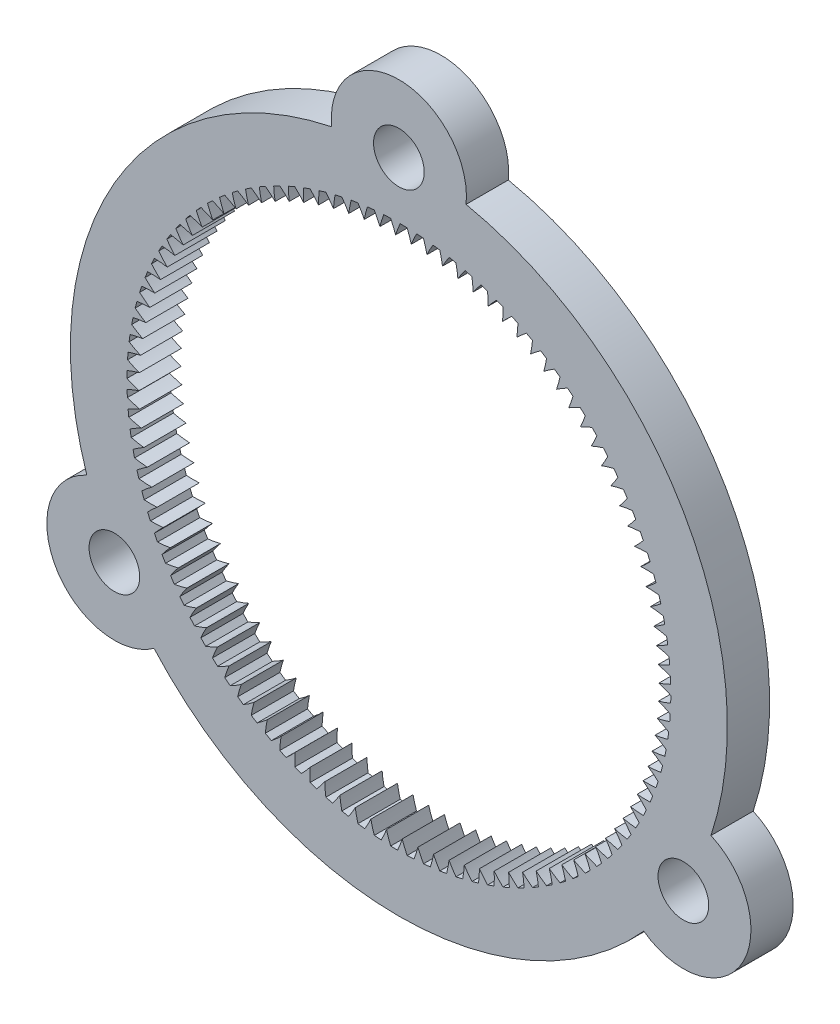
from build123d import *

# Parameters (mm, degrees)
ESQUISSE1_R                                = 19.45
ESQUISSE1_R_2                              = 12.5
BOSS_EXTRU_1_DEPTH                         = 2.5
ESQUISSE1_9_R                              = 1.5
ENL_V_MAT_EXTRU_1_DEPTH                    = 2.5
ESQUISSE1_10_R                             = 4
ESQUISSE1_10_R_2                           = 1.5
BOSS_EXTRU_2_DEPTH                         = 2.5
R_P_TITION_CIRCULAIRE1_COUNT               = 2
R_P_TITION_CIRCULAIRE1_ANGLE               = 120
R_P_TITION_CIRCULAIRE1_THE_OTHER_WAY_COUNT = 2
R_P_TITION_CIRCULAIRE1_THE_OTHER_WAY_ANGLE = 120
ENL_V_MAT_EXTRU_2_DEPTH                    = 10


with BuildPart() as part:
    # Esquisse1 → Boss.-Extru.1 (new body)
    with BuildSketch(Plane.XY):
        Circle(ESQUISSE1_R)
        Circle(ESQUISSE1_R_2, mode=Mode.SUBTRACT)
    extrude(amount=BOSS_EXTRU_1_DEPTH)

    # Esquisse1<9> → Enlèv. mat.-Extru.1 (cut)
    with BuildSketch(Plane.XY):
        with Locations((0, 19.45)):
            Circle(ESQUISSE1_9_R)
    enl_v_mat_extru_1 = extrude(amount=ENL_V_MAT_EXTRU_1_DEPTH, mode=Mode.SUBTRACT)

    # Esquisse1<10> → Boss.-Extru.2 (add)
    with BuildSketch(Plane.XY):
        with Locations((0, 19.45)):
            Circle(ESQUISSE1_10_R)
        with Locations(Location((0, 19.45, 0), (0, 0, 180))):
            Circle(ESQUISSE1_10_R_2, mode=Mode.SUBTRACT)
    boss_extru_2 = extrude(amount=BOSS_EXTRU_2_DEPTH)

    # Répétition circulaire1: Enlèv. mat.-Extru.1, Boss.-Extru.2 ×2 about axis
    r_p_tition_circulaire1_axis = Axis((0, 0, 2.5), (0, 0, -1))
    add([enl_v_mat_extru_1.rotate(r_p_tition_circulaire1_axis, i * R_P_TITION_CIRCULAIRE1_ANGLE / (R_P_TITION_CIRCULAIRE1_COUNT - 1)) for i in range(1, R_P_TITION_CIRCULAIRE1_COUNT)], mode=Mode.SUBTRACT)
    add([boss_extru_2.rotate(r_p_tition_circulaire1_axis, i * R_P_TITION_CIRCULAIRE1_ANGLE / (R_P_TITION_CIRCULAIRE1_COUNT - 1)) for i in range(1, R_P_TITION_CIRCULAIRE1_COUNT)])

    # Répétition circulaire1 the other way: Enlèv. mat.-Extru.1, Boss.-Extru.2 ×2 about axis
    r_p_tition_circulaire1_the_other_way_axis = Axis((0, 0, 2.5), (0, 0, 1))
    add([enl_v_mat_extru_1.rotate(r_p_tition_circulaire1_the_other_way_axis, i * R_P_TITION_CIRCULAIRE1_THE_OTHER_WAY_ANGLE / (R_P_TITION_CIRCULAIRE1_THE_OTHER_WAY_COUNT - 1)) for i in range(1, R_P_TITION_CIRCULAIRE1_THE_OTHER_WAY_COUNT)], mode=Mode.SUBTRACT)
    add([boss_extru_2.rotate(r_p_tition_circulaire1_the_other_way_axis, i * R_P_TITION_CIRCULAIRE1_THE_OTHER_WAY_ANGLE / (R_P_TITION_CIRCULAIRE1_THE_OTHER_WAY_COUNT - 1)) for i in range(1, R_P_TITION_CIRCULAIRE1_THE_OTHER_WAY_COUNT)])

    # Esquisse4 → Enlèv. mat.-Extru.2 (cut)
    with BuildSketch(Plane(origin=(0, 0, 0), x_dir=(-1, 0, 0), z_dir=(0, 0, -1))):
        with BuildLine():
            ThreePointArc((8.263026843, 13.817828606), (8.086986682, 13.92158922), (7.90964378, 14.023107191))
            add(Edge.make_bspline(
                [(7.90964378, 14.023107191), (7.860100184, 13.985345352), (7.761700913, 13.911220116), (7.610836631, 13.790511957), (7.465388225, 13.665848862), (7.37060976, 13.578434951), (7.324255188, 13.533878102)],
                knots=[-0.016410395, -0.016410395, -0.016410395, -0.016410395, 0.006551733, 0.029513861, 0.052475988, 0.075438116, 0.075438116, 0.075438116, 0.075438116], degree=3))
            add(Edge.make_bspline(
                [(7.324255188, 13.533878102), (7.336203765, 13.597054765), (7.357546113, 13.724210785), (7.382359021, 13.914159319), (7.400898809, 14.10647876), (7.409135888, 14.229397911), (7.41365167, 14.291527872)],
                knots=[0.084971235, 0.084971235, 0.084971235, 0.084971235, 0.107933362, 0.13089549, 0.153857617, 0.176819745, 0.176819745, 0.176819745, 0.176819745], degree=3))
            ThreePointArc((7.41365167, 14.291527872), (7.231667774, 14.38447014), (7.048518922, 14.475095198))
            add(Edge.make_bspline(
                [(7.048518922, 14.475095198), (7.001345719, 14.434410886), (6.907601542, 14.354479688), (6.764300681, 14.224882796), (6.626644609, 14.091665185), (6.537316983, 13.998688175), (6.493737257, 13.951413798)],
                knots=[-0.016410395, -0.016410395, -0.016410395, -0.016410395, 0.006551733, 0.029513861, 0.052475988, 0.075438116, 0.075438116, 0.075438116, 0.075438116], degree=3))
            add(Edge.make_bspline(
                [(6.493737257, 13.951413798), (6.501849523, 14.015196636), (6.515475444, 14.143409285), (6.528774275, 14.334509435), (6.535668279, 14.527597404), (6.536468656, 14.650789638), (6.537224886, 14.713078903)],
                knots=[0.084971235, 0.084971235, 0.084971235, 0.084971235, 0.107933362, 0.13089549, 0.153857617, 0.176819745, 0.176819745, 0.176819745, 0.176819745], degree=3))
            ThreePointArc((6.537224886, 14.713078903), (6.349961295, 14.794863688), (6.161674783, 14.874265154))
            add(Edge.make_bspline(
                [(6.161674783, 14.874265154), (6.117044103, 14.830806821), (6.028297083, 14.74536132), (5.893082532, 14.60734858), (5.763721085, 14.466062551), (5.680170245, 14.367861704), (5.639524383, 14.318042299)],
                knots=[-0.016410395, -0.016410395, -0.016410395, -0.016410395, 0.006551733, 0.029513861, 0.052475988, 0.075438116, 0.075438116, 0.075438116, 0.075438116], degree=3))
            add(Edge.make_bspline(
                [(5.639524383, 14.318042299), (5.643770737, 14.382198574), (5.649630511, 14.511000019), (5.651366739, 14.70255448), (5.646589804, 14.895706421), (5.639950559, 15.018722223), (5.636944477, 15.080943504)],
                knots=[0.084971235, 0.084971235, 0.084971235, 0.084971235, 0.107933362, 0.13089549, 0.153857617, 0.176819745, 0.176819745, 0.176819745, 0.176819745], degree=3))
            ThreePointArc((5.636944477, 15.080943504), (5.445084496, 15.151272383), (5.252347362, 15.219160529))
            add(Edge.make_bspline(
                [(5.252347362, 15.219160529), (5.210422056, 15.173086749), (5.126996021, 15.082438728), (5.000361164, 14.936513733), (4.879766368, 14.787674823), (4.802297181, 14.684608464), (4.764733497, 14.632425815)],
                knots=[-0.016410395, -0.016410395, -0.016410395, -0.016410395, 0.006551733, 0.029513861, 0.052475988, 0.075438116, 0.075438116, 0.075438116, 0.075438116], degree=3))
            add(Edge.make_bspline(
                [(4.764733497, 14.632425815), (4.765098444, 14.69672143), (4.763170689, 14.825641688), (4.753337979, 15.016951499), (4.736907535, 15.20946262), (4.722852894, 15.331853119), (4.716095469, 15.393779378)],
                knots=[0.084971235, 0.084971235, 0.084971235, 0.084971235, 0.107933362, 0.13089549, 0.153857617, 0.176819745, 0.176819745, 0.176819745, 0.176819745], degree=3))
            ThreePointArc((4.716095469, 15.393779378), (4.520339174, 15.452395728), (4.323854694, 15.508522837))
            add(Edge.make_bspline(
                [(4.323854694, 15.508522837), (4.284787745, 15.46000173), (4.206987107, 15.364481952), (4.08939402, 15.211177167), (3.978005913, 15.055328473), (3.906901056, 14.94777268), (3.872556615, 14.893417197)],
                knots=[-0.016410395, -0.016410395, -0.016410395, -0.016410395, 0.006551733, 0.029513861, 0.052475988, 0.075438116, 0.075438116, 0.075438116, 0.075438116], degree=3))
            add(Edge.make_bspline(
                [(3.872556615, 14.893417197), (3.869038823, 14.957617542), (3.859330574, 15.086186198), (3.837964804, 15.27655329), (3.809940805, 15.467721139), (3.788522051, 15.589039745), (3.77803794, 15.65044502)],
                knots=[0.084971235, 0.084971235, 0.084971235, 0.084971235, 0.107933362, 0.13089549, 0.153857617, 0.176819745, 0.176819745, 0.176819745, 0.176819745], degree=3))
            ThreePointArc((3.77803794, 15.65044502), (3.579099625, 15.697134958), (3.379584749, 15.741296227))
            add(Edge.make_bspline(
                [(3.379584749, 15.741296227), (3.343518707, 15.690504841), (3.271627353, 15.590461848), (3.163505121, 15.430336665), (3.061730145, 15.268046862), (2.997249073, 15.156394095), (2.966249193, 15.100064114)],
                knots=[-0.016410395, -0.016410395, -0.016410395, -0.016410395, 0.006551733, 0.029513861, 0.052475988, 0.075438116, 0.075438116, 0.075438116, 0.075438116], degree=3))
            add(Edge.make_bspline(
                [(2.966249193, 15.100064114), (2.958861499, 15.163934931), (2.94140818, 15.29168285), (2.908587312, 15.480412595), (2.869072013, 15.669539622), (2.840367302, 15.789343656), (2.82619476, 15.850003886)],
                knots=[0.084971235, 0.084971235, 0.084971235, 0.084971235, 0.107933362, 0.13089549, 0.153857617, 0.176819745, 0.176819745, 0.176819745, 0.176819745], degree=3))
            ThreePointArc((2.82619476, 15.850003886), (2.624800329, 15.884597043), (2.422983067, 15.916631335))
            add(Edge.make_bspline(
                [(2.422983067, 15.916631335), (2.390049532, 15.863755001), (2.324329786, 15.75955384), (2.226072935, 15.593192539), (2.134282457, 15.425053804), (2.076660452, 15.309711471), (2.04911825, 15.251612536)],
                knots=[-0.016410395, -0.016410395, -0.016410395, -0.016410395, 0.006551733, 0.029513861, 0.052475988, 0.075438116, 0.075438116, 0.075438116, 0.075438116], degree=3))
            add(Edge.make_bspline(
                [(2.04911825, 15.251612536), (2.037887611, 15.314920765), (2.012752907, 15.44138181), (1.968596701, 15.627785553), (1.917734289, 15.814181654), (1.88184836, 15.932033965), (1.864039102, 15.991727806)],
                knots=[0.084971235, 0.084971235, 0.084971235, 0.084971235, 0.107933362, 0.13089549, 0.153857617, 0.176819745, 0.176819745, 0.176819745, 0.176819745], degree=3))
            ThreePointArc((1.864039102, 15.991727806), (1.660923422, 16.014097957), (1.457540181, 16.033888381))
            add(Edge.make_bspline(
                [(1.457540181, 16.033888381), (1.427859326, 15.97912004), (1.368550992, 15.871140928), (1.28051805, 15.699150543), (1.199047003, 15.525776398), (1.148494323, 15.40716537), (1.124510297, 15.347509476)],
                knots=[-0.016410395, -0.016410395, -0.016410395, -0.016410395, 0.006551733, 0.029513861, 0.052475988, 0.075438116, 0.075438116, 0.075438116, 0.075438116], degree=3))
            add(Edge.make_bspline(
                [(1.124510297, 15.347509476), (1.109477692, 15.410024115), (1.076753317, 15.534736843), (1.021422893, 15.718134416), (0.959398961, 15.901119452), (0.916462758, 16.016590009), (0.895081768, 16.075099646)],
                knots=[0.084971235, 0.084971235, 0.084971235, 0.084971235, 0.107933362, 0.13089549, 0.153857617, 0.176819745, 0.176819745, 0.176819745, 0.176819745], degree=3))
            ThreePointArc((0.895081768, 16.075099646), (0.690985985, 16.085165164), (0.48677889, 16.092639507))
            add(Edge.make_bspline(
                [(0.48677889, 16.092639507), (0.460459016, 16.036179003), (0.407778503, 15.924815945), (0.330290694, 15.74782405), (0.259436356, 15.569847117), (0.216137463, 15.448400194), (0.195799128, 15.38740502)],
                knots=[-0.016410395, -0.016410395, -0.016410395, -0.016410395, 0.006551733, 0.029513861, 0.052475988, 0.075438116, 0.075438116, 0.075438116, 0.075438116], degree=3))
            add(Edge.make_bspline(
                [(0.195799128, 15.38740502), (0.177019408, 15.448897957), (0.13682477, 15.571407305), (0.070522024, 15.751129512), (-0.00243711, 15.930035789), (-0.052266917, 16.042703253), (-0.077141623, 16.099815191)],
                knots=[0.084971235, 0.084971235, 0.084971235, 0.084971235, 0.107933362, 0.13089549, 0.153857617, 0.176819745, 0.176819745, 0.176819745, 0.176819745], degree=3))
            ThreePointArc((-0.077141623, 16.099815191), (-0.281472785, 16.097539348), (-0.485758605, 16.092670337))
            add(Edge.make_bspline(
                [(-0.485758605, 16.092670337), (-0.508621459, 16.034723687), (-0.554481925, 15.920383035), (-0.621141857, 15.739035455), (-0.681120945, 15.557105153), (-0.717008059, 15.433265481), (-0.733626492, 15.371153591)],
                knots=[-0.016410395, -0.016410395, -0.016410395, -0.016410395, 0.006551733, 0.029513861, 0.052475988, 0.075438116, 0.075438116, 0.075438116, 0.075438116], degree=3))
            add(Edge.make_bspline(
                [(-0.733626492, 15.371153591), (-0.756084799, 15.431400446), (-0.803603035, 15.551259391), (-0.880636172, 15.726650444), (-0.964264289, 15.900825154), (-1.020805876, 16.010278413), (-1.049083532, 16.065784255)],
                knots=[0.084971235, 0.084971235, 0.084971235, 0.084971235, 0.107933362, 0.13089549, 0.153857617, 0.176819745, 0.176819745, 0.176819745, 0.176819745], degree=3))
            ThreePointArc((-1.049083532, 16.065784255), (-1.252904491, 16.051175357), (-1.456523619, 16.033980758))
            add(Edge.make_bspline(
                [(-1.456523619, 16.033980758), (-1.47584603, 15.974759404), (-1.514719109, 15.857858374), (-1.570307929, 15.672816826), (-1.619192911, 15.487596999), (-1.647537297, 15.361816456), (-1.660375187, 15.298814489)],
                knots=[-0.016410395, -0.016410395, -0.016410395, -0.016410395, 0.006551733, 0.029513861, 0.052475988, 0.075438116, 0.075438116, 0.075438116, 0.075438116], degree=3))
            add(Edge.make_bspline(
                [(-1.660375187, 15.298814489), (-1.686430136, 15.357595429), (-1.74109858, 15.474366617), (-1.828581023, 15.644786534), (-1.922572971, 15.813594131), (-1.985620025, 15.919433804), (-2.017197449, 15.973131016)],
                knots=[0.084971235, 0.084971235, 0.084971235, 0.084971235, 0.107933362, 0.13089549, 0.153857617, 0.176819745, 0.176819745, 0.176819745, 0.176819745], degree=3))
            ThreePointArc((-2.017197449, 15.973131016), (-2.219764485, 15.946242367), (-2.421973936, 15.916784922))
            add(Edge.make_bspline(
                [(-2.421973936, 15.916784922), (-2.437685398, 15.856504956), (-2.469429247, 15.737470107), (-2.513744118, 15.549409788), (-2.551356616, 15.361576283), (-2.57205485, 15.234313828), (-2.581065354, 15.170651673)],
                knots=[-0.016410395, -0.016410395, -0.016410395, -0.016410395, 0.006551733, 0.029513861, 0.052475988, 0.075438116, 0.075438116, 0.075438116, 0.075438116], degree=3))
            add(Edge.make_bspline(
                [(-2.581065354, 15.170651673), (-2.610621871, 15.227752211), (-2.672241045, 15.341009558), (-2.769853579, 15.505836495), (-2.873866394, 15.668661019), (-2.943188861, 15.770500906), (-2.977950832, 15.822193553)],
                knots=[0.084971235, 0.084971235, 0.084971235, 0.084971235, 0.107933362, 0.13089549, 0.153857617, 0.176819745, 0.176819745, 0.176819745, 0.176819745], degree=3))
            ThreePointArc((-2.977950832, 15.822193553), (-3.178524799, 15.783123268), (-3.378586734, 15.741510464))
            add(Edge.make_bspline(
                [(-3.378586734, 15.741510464), (-3.390629917, 15.680391841), (-3.415128706, 15.559657519), (-3.448007927, 15.369264641), (-3.474210699, 15.179502841), (-3.487187253, 15.051222841), (-3.492337493, 14.987132794)],
                knots=[-0.016410395, -0.016410395, -0.016410395, -0.016410395, 0.006551733, 0.029513861, 0.052475988, 0.075438116, 0.075438116, 0.075438116, 0.075438116], degree=3))
            add(Edge.make_bspline(
                [(-3.492337493, 14.987132794), (-3.525287731, 15.042344577), (-3.593632792, 15.151674819), (-3.70101924, 15.31030734), (-3.814673389, 15.466554662), (-3.890018321, 15.564023161), (-3.927837995, 15.613522623)],
                knots=[0.084971235, 0.084971235, 0.084971235, 0.084971235, 0.107933362, 0.13089549, 0.153857617, 0.176819745, 0.176819745, 0.176819745, 0.176819745], degree=3))
            ThreePointArc((-3.927837995, 15.613522623), (-4.12568702, 15.562413264), (-4.322871434, 15.508796941))
            add(Edge.make_bspline(
                [(-4.322871434, 15.508796941), (-4.331202395, 15.447062676), (-4.34836673, 15.325069428), (-4.369690329, 15.133038713), (-4.384387763, 14.942041039), (-4.389595289, 14.813211575), (-4.390866472, 14.748927492)],
                knots=[-0.016410395, -0.016410395, -0.016410395, -0.016410395, 0.006551733, 0.029513861, 0.052475988, 0.075438116, 0.075438116, 0.075438116, 0.075438116], degree=3))
            add(Edge.make_bspline(
                [(-4.390866472, 14.748927492), (-4.427090198, 14.802049059), (-4.501911763, 14.907053262), (-4.618680284, 15.058912534), (-4.741561055, 15.208012524), (-4.822653526, 15.300753984), (-4.863392903, 15.347879641)],
                knots=[0.084971235, 0.084971235, 0.084971235, 0.084971235, 0.107933362, 0.13089549, 0.153857617, 0.176819745, 0.176819745, 0.176819745, 0.176819745], degree=3))
            ThreePointArc((-4.863392903, 15.347879641), (-5.057795057, 15.284917702), (-5.251382446, 15.2194935))
            add(Edge.make_bspline(
                [(-5.251382446, 15.2194935), (-5.255970785, 15.157368855), (-5.265738036, 15.03456182), (-5.275428205, 14.841593968), (-5.278566671, 14.65005735), (-5.275986167, 14.521148506), (-5.273373654, 14.456904954)],
                knots=[-0.016410395, -0.016410395, -0.016410395, -0.016410395, 0.006551733, 0.029513861, 0.052475988, 0.075438116, 0.075438116, 0.075438116, 0.075438116], degree=3))
            add(Edge.make_bspline(
                [(-5.273373654, 14.456904954), (-5.312738693, 14.507742469), (-5.393763746, 14.608037484), (-5.519488264, 14.752569389), (-5.651147279, 14.893977998), (-5.737691391, 14.981654014), (-5.781201817, 15.026233911)],
                knots=[0.084971235, 0.084971235, 0.084971235, 0.084971235, 0.107933362, 0.13089549, 0.153857617, 0.176819745, 0.176819745, 0.176819745, 0.176819745], degree=3))
            ThreePointArc((-5.781201817, 15.026233911), (-5.971447748, 14.951649133), (-6.160731733, 14.874655778))
            add(Edge.make_bspline(
                [(-6.160731733, 14.874655778), (-6.161560707, 14.812367439), (-6.163895234, 14.689194727), (-6.161916615, 14.495993856), (-6.153484663, 14.304617191), (-6.143125544, 14.176099341), (-6.136638869, 14.112130737)],
                knots=[-0.016410395, -0.016410395, -0.016410395, -0.016410395, 0.006551733, 0.029513861, 0.052475988, 0.075438116, 0.075438116, 0.075438116, 0.075438116], degree=3))
            add(Edge.make_bspline(
                [(-6.136638869, 14.112130737), (-6.17900158, 14.1604987), (-6.26593447, 14.255718561), (-6.400156229, 14.392395718), (-6.54011308, 14.525596961), (-6.631793043, 14.607887614), (-6.677915754, 14.649759083)],
                knots=[0.084971235, 0.084971235, 0.084971235, 0.084971235, 0.107933362, 0.13089549, 0.153857617, 0.176819745, 0.176819745, 0.176819745, 0.176819745], degree=3))
            ThreePointArc((-6.677915754, 14.649759083), (-6.863311274, 14.563823617), (-7.047601177, 14.47554205))
            add(Edge.make_bspline(
                [(-7.047601177, 14.47554205), (-7.044667763, 14.413317301), (-7.039561048, 14.290228355), (-7.02592086, 14.097499435), (-7.005949256, 13.906981035), (-6.987849322, 13.779323126), (-6.977512153, 13.715862885)],
                knots=[-0.016410395, -0.016410395, -0.016410395, -0.016410395, 0.006551733, 0.029513861, 0.052475988, 0.075438116, 0.075438116, 0.075438116, 0.075438116], degree=3))
            add(Edge.make_bspline(
                [(-6.977512153, 13.715862885), (-7.022717961, 13.761584807), (-7.115241479, 13.851382067), (-7.257470719, 13.979705756), (-7.405214717, 14.104213597), (-7.501696001, 14.180818616), (-7.550262699, 14.219828873)],
                knots=[0.084971235, 0.084971235, 0.084971235, 0.084971235, 0.107933362, 0.13089549, 0.153857617, 0.176819745, 0.176819745, 0.176819745, 0.176819745], degree=3))
            ThreePointArc((-7.550262699, 14.219828873), (-7.730131322, 14.122856289), (-7.908754689, 14.023608639))
            add(Edge.make_bspline(
                [(-7.908754689, 14.023608639), (-7.90206959, 13.961674531), (-7.889540266, 13.83911849), (-7.864288282, 13.647564767), (-7.8328499, 13.458599813), (-7.807075196, 13.332267656), (-7.792925252, 13.269547338)],
                knots=[-0.016410395, -0.016410395, -0.016410395, -0.016410395, 0.006551733, 0.029513861, 0.052475988, 0.075438116, 0.075438116, 0.075438116, 0.075438116], degree=3))
            add(Edge.make_bspline(
                [(-7.792925252, 13.269547338), (-7.840809206, 13.312456383), (-7.938585743, 13.396503383), (-8.088303485, 13.516005364), (-8.243295528, 13.631365486), (-8.344226083, 13.702005349), (-8.395059555, 13.738012049)],
                knots=[0.084971235, 0.084971235, 0.084971235, 0.084971235, 0.107933362, 0.13089549, 0.153857617, 0.176819745, 0.176819745, 0.176819745, 0.176819745], degree=3))
            ThreePointArc((-8.395059555, 13.738012049), (-8.568744958, 13.630356189), (-8.741050013, 13.520504601))
            add(Edge.make_bspline(
                [(-8.741050013, 13.520504601), (-8.730637622, 13.459087124), (-8.710731408, 13.337511182), (-8.673959769, 13.147831616), (-8.631169324, 12.96110962), (-8.597813899, 12.836564187), (-8.579902812, 12.774812651)],
                knots=[-0.016410395, -0.016410395, -0.016410395, -0.016410395, 0.006551733, 0.029513861, 0.052475988, 0.075438116, 0.075438116, 0.075438116, 0.075438116], degree=3))
            add(Edge.make_bspline(
                [(-8.579902812, 12.774812651), (-8.630290188, 12.81475225), (-8.732962969, 12.89274231), (-8.889622909, 13.002986534), (-9.051297449, 13.108778001), (-9.15630899, 13.17319495), (-9.20922375, 13.206066709)],
                knots=[0.084971235, 0.084971235, 0.084971235, 0.084971235, 0.107933362, 0.13089549, 0.153857617, 0.176819745, 0.176819745, 0.176819745, 0.176819745], degree=3))
            ThreePointArc((-9.20922375, 13.206066709), (-9.376092174, 13.088120398), (-9.541450194, 12.968065708))
            add(Edge.make_bspline(
                [(-9.541450194, 12.968065708), (-9.527348505, 12.907388968), (-9.500138035, 12.787236742), (-9.451980917, 12.600123452), (-9.397994547, 12.416325743), (-9.357180111, 12.294021487), (-9.335573238, 12.233464058)],
                knots=[-0.016410395, -0.016410395, -0.016410395, -0.016410395, 0.006551733, 0.029513861, 0.052475988, 0.075438116, 0.075438116, 0.075438116, 0.075438116], degree=3))
            add(Edge.make_bspline(
                [(-9.335573238, 12.233464058), (-9.388280177, 12.270288475), (-9.495474559, 12.341937018), (-9.658505063, 12.442521216), (-9.826272166, 12.538358007), (-9.934981518, 12.596316991), (-9.989784485, 12.625933864)],
                knots=[0.084971235, 0.084971235, 0.084971235, 0.084971235, 0.107933362, 0.13089549, 0.153857617, 0.176819745, 0.176819745, 0.176819745, 0.176819745], degree=3))
            ThreePointArc((-9.989784485, 12.625933864), (-10.149227046, 12.498127475), (-10.307034657, 12.368307749))
            add(Edge.make_bspline(
                [(-10.307034657, 12.368307749), (-10.289295126, 12.30859315), (-10.254879689, 12.190303062), (-10.195512811, 12.006438805), (-10.130527508, 11.826236041), (-10.082402988, 11.706619237), (-10.057179169, 11.647476882)],
                knots=[-0.016410395, -0.016410395, -0.016410395, -0.016410395, 0.006551733, 0.029513861, 0.052475988, 0.075438116, 0.075438116, 0.075438116, 0.075438116], degree=3))
            add(Edge.make_bspline(
                [(-10.057179169, 11.647476882), (-10.11201335, 11.681051749), (-10.223338193, 11.746097337), (-10.392144379, 11.836654487), (-10.565391882, 11.922186904), (-10.677402376, 11.973476438), (-10.73389358, 11.999730356)],
                knots=[0.084971235, 0.084971235, 0.084971235, 0.084971235, 0.107933362, 0.13089549, 0.153857617, 0.176819745, 0.176819745, 0.176819745, 0.176819745], degree=3))
            ThreePointArc((-10.73389358, 11.999730356), (-10.885328489, 11.86253024), (-11.035009869, 11.723419177))
            add(Edge.make_bspline(
                [(-11.035009869, 11.723419177), (-11.013697224, 11.66488461), (-10.972202399, 11.548888288), (-10.901842385, 11.368943964), (-10.826095272, 11.192993685), (-10.77083627, 11.076500802), (-10.742087543, 11.018989325)],
                knots=[-0.016410395, -0.016410395, -0.016410395, -0.016410395, 0.006551733, 0.029513861, 0.052475988, 0.075438116, 0.075438116, 0.075438116, 0.075438116], degree=3))
            add(Edge.make_bspline(
                [(-10.742087543, 11.018989325), (-10.798848883, 11.049192131), (-10.913897975, 11.107397421), (-11.087863888, 11.187597091), (-11.265959628, 11.262513034), (-11.38086255, 11.306945968), (-11.438835862, 11.329741133)],
                knots=[0.084971235, 0.084971235, 0.084971235, 0.084971235, 0.107933362, 0.13089549, 0.153857617, 0.176819745, 0.176819745, 0.176819745, 0.176819745], degree=3))
            ThreePointArc((-11.438835862, 11.329741133), (-11.581710549, 11.183647919), (-11.722719526, 11.035753119))
            add(Edge.make_bspline(
                [(-11.722719526, 11.035753119), (-11.697911536, 10.978612171), (-11.649488733, 10.865332874), (-11.568392319, 10.68996508), (-11.482159788, 10.51890931), (-11.419967938, 10.405965417), (-11.387799206, 10.350294671)],
                knots=[-0.016410395, -0.016410395, -0.016410395, -0.016410395, 0.006551733, 0.029513861, 0.052475988, 0.075438116, 0.075438116, 0.075438116, 0.075438116], degree=3))
            add(Edge.make_bspline(
                [(-11.387799206, 10.350294671), (-11.446280588, 10.37701521), (-11.564634127, 10.428167816), (-11.743124984, 10.497717365), (-11.92541911, 10.561743475), (-12.042795192, 10.599157678), (-12.102039072, 10.618410913)],
                knots=[0.084971235, 0.084971235, 0.084971235, 0.084971235, 0.107933362, 0.13089549, 0.153857617, 0.176819745, 0.176819745, 0.176819745, 0.176819745], degree=3))
            ThreePointArc((-12.102039072, 10.618410913), (-12.235832203, 10.463957679), (-12.367654251, 10.307818795))
            add(Edge.make_bspline(
                [(-12.367654251, 10.307818795), (-12.339441438, 10.252279967), (-12.284267345, 10.142131037), (-12.192730443, 9.971979673), (-12.096327149, 9.806442575), (-12.027429382, 9.697459792), (-11.991958024, 9.643832915)],
                knots=[-0.016410395, -0.016410395, -0.016410395, -0.016410395, 0.006551733, 0.029513861, 0.052475988, 0.075438116, 0.075438116, 0.075438116, 0.075438116], degree=3))
            add(Edge.make_bspline(
                [(-11.991958024, 9.643832915), (-12.051946056, 9.666973686), (-12.173172182, 9.710886957), (-12.35553669, 9.769532607), (-12.541364031, 9.82243526), (-12.660784979, 9.852694211), (-12.721083253, 9.868335263)],
                knots=[0.084971235, 0.084971235, 0.084971235, 0.084971235, 0.107933362, 0.13089549, 0.153857617, 0.176819745, 0.176819745, 0.176819745, 0.176819745], degree=3))
            ThreePointArc((-12.721083253, 9.868335263), (-12.845306632, 9.706085592), (-12.967460747, 9.542272359))
            add(Edge.make_bspline(
                [(-12.967460747, 9.542272359), (-12.935946055, 9.488538305), (-12.874221998, 9.381921665), (-12.772578617, 9.217607593), (-12.666356324, 9.058193195), (-12.59100404, 8.953569189), (-12.552359487, 8.902181858)],
                knots=[-0.016410395, -0.016410395, -0.016410395, -0.016410395, 0.006551733, 0.029513861, 0.052475988, 0.075438116, 0.075438116, 0.075438116, 0.075438116], degree=3))
            add(Edge.make_bspline(
                [(-12.552359487, 8.902181858), (-12.613635279, 8.921658422), (-12.737291653, 8.958172125), (-12.922864382, 9.005699885), (-13.111546874, 9.047286043), (-13.232576936, 9.070279331), (-13.293709582, 9.082251128)],
                knots=[0.084971235, 0.084971235, 0.084971235, 0.084971235, 0.107933362, 0.13089549, 0.153857617, 0.176819745, 0.176819745, 0.176819745, 0.176819745], degree=3))
            ThreePointArc((-13.293709582, 9.082251128), (-13.407909931, 8.912797052), (-13.519950385, 8.741907205))
            add(Edge.make_bspline(
                [(-13.519950385, 8.741907205), (-13.485248809, 8.690173996), (-13.417200011, 8.587478678), (-13.305821036, 8.429601462), (-13.190167338, 8.27689145), (-13.10863549, 8.177007982), (-13.066958752, 8.128047705)],
                knots=[-0.016410395, -0.016410395, -0.016410395, -0.016410395, 0.006551733, 0.029513861, 0.052475988, 0.075438116, 0.075438116, 0.075438116, 0.075438116], degree=3))
            add(Edge.make_bspline(
                [(-13.066958752, 8.128047705), (-13.129298716, 8.143788995), (-13.254934127, 8.172769895), (-13.443037944, 8.20900634), (-13.633887105, 8.239124262), (-13.756084654, 8.254767986), (-13.817828606, 8.263026843)],
                knots=[0.084971235, 0.084971235, 0.084971235, 0.084971235, 0.107933362, 0.13089549, 0.153857617, 0.176819745, 0.176819745, 0.176819745, 0.176819745], degree=3))
            ThreePointArc((-13.817828606, 8.263026843), (-13.92158922, 8.086986682), (-14.023107191, 7.90964378))
            add(Edge.make_bspline(
                [(-14.023107191, 7.90964378), (-13.985345352, 7.860100184), (-13.911220116, 7.761700913), (-13.790511957, 7.610836631), (-13.665848862, 7.465388225), (-13.578434951, 7.37060976), (-13.533878102, 7.324255188)],
                knots=[-0.016410395, -0.016410395, -0.016410395, -0.016410395, 0.006551733, 0.029513861, 0.052475988, 0.075438116, 0.075438116, 0.075438116, 0.075438116], degree=3))
            add(Edge.make_bspline(
                [(-13.533878102, 7.324255188), (-13.597054765, 7.336203765), (-13.724210785, 7.357546113), (-13.914159319, 7.382359021), (-14.10647876, 7.400898809), (-14.229397911, 7.409135888), (-14.291527872, 7.41365167)],
                knots=[0.084971235, 0.084971235, 0.084971235, 0.084971235, 0.107933362, 0.13089549, 0.153857617, 0.176819745, 0.176819745, 0.176819745, 0.176819745], degree=3))
            ThreePointArc((-14.291527872, 7.41365167), (-14.38447014, 7.231667774), (-14.475095198, 7.048518922))
            add(Edge.make_bspline(
                [(-14.475095198, 7.048518922), (-14.434410886, 7.001345719), (-14.354479688, 6.907601542), (-14.224882796, 6.764300681), (-14.091665185, 6.626644609), (-13.998688175, 6.537316983), (-13.951413798, 6.493737257)],
                knots=[-0.016410395, -0.016410395, -0.016410395, -0.016410395, 0.006551733, 0.029513861, 0.052475988, 0.075438116, 0.075438116, 0.075438116, 0.075438116], degree=3))
            add(Edge.make_bspline(
                [(-13.951413798, 6.493737257), (-14.015196636, 6.501849523), (-14.143409285, 6.515475444), (-14.334509435, 6.528774275), (-14.527597404, 6.535668279), (-14.650789638, 6.536468656), (-14.713078903, 6.537224886)],
                knots=[0.084971235, 0.084971235, 0.084971235, 0.084971235, 0.107933362, 0.13089549, 0.153857617, 0.176819745, 0.176819745, 0.176819745, 0.176819745], degree=3))
            ThreePointArc((-14.713078903, 6.537224886), (-14.794863688, 6.349961295), (-14.874265154, 6.161674783))
            add(Edge.make_bspline(
                [(-14.874265154, 6.161674783), (-14.830806821, 6.117044103), (-14.74536132, 6.028297083), (-14.60734858, 5.893082532), (-14.466062551, 5.763721085), (-14.367861704, 5.680170245), (-14.318042299, 5.639524383)],
                knots=[-0.016410395, -0.016410395, -0.016410395, -0.016410395, 0.006551733, 0.029513861, 0.052475988, 0.075438116, 0.075438116, 0.075438116, 0.075438116], degree=3))
            add(Edge.make_bspline(
                [(-14.318042299, 5.639524383), (-14.382198574, 5.643770737), (-14.511000019, 5.649630511), (-14.70255448, 5.651366739), (-14.895706421, 5.646589804), (-15.018722223, 5.639950559), (-15.080943504, 5.636944477)],
                knots=[0.084971235, 0.084971235, 0.084971235, 0.084971235, 0.107933362, 0.13089549, 0.153857617, 0.176819745, 0.176819745, 0.176819745, 0.176819745], degree=3))
            ThreePointArc((-15.080943504, 5.636944477), (-15.151272383, 5.445084496), (-15.219160529, 5.252347362))
            add(Edge.make_bspline(
                [(-15.219160529, 5.252347362), (-15.173086749, 5.210422056), (-15.082438728, 5.126996021), (-14.936513733, 5.000361164), (-14.787674823, 4.879766368), (-14.684608464, 4.802297181), (-14.632425815, 4.764733497)],
                knots=[-0.016410395, -0.016410395, -0.016410395, -0.016410395, 0.006551733, 0.029513861, 0.052475988, 0.075438116, 0.075438116, 0.075438116, 0.075438116], degree=3))
            add(Edge.make_bspline(
                [(-14.632425815, 4.764733497), (-14.69672143, 4.765098444), (-14.825641688, 4.763170689), (-15.016951499, 4.753337979), (-15.20946262, 4.736907535), (-15.331853119, 4.722852894), (-15.393779378, 4.716095469)],
                knots=[0.084971235, 0.084971235, 0.084971235, 0.084971235, 0.107933362, 0.13089549, 0.153857617, 0.176819745, 0.176819745, 0.176819745, 0.176819745], degree=3))
            ThreePointArc((-15.393779378, 4.716095469), (-15.452395728, 4.520339174), (-15.508522837, 4.323854694))
            add(Edge.make_bspline(
                [(-15.508522837, 4.323854694), (-15.46000173, 4.284787745), (-15.364481952, 4.206987107), (-15.211177167, 4.08939402), (-15.055328473, 3.978005913), (-14.94777268, 3.906901056), (-14.893417197, 3.872556615)],
                knots=[-0.016410395, -0.016410395, -0.016410395, -0.016410395, 0.006551733, 0.029513861, 0.052475988, 0.075438116, 0.075438116, 0.075438116, 0.075438116], degree=3))
            add(Edge.make_bspline(
                [(-14.893417197, 3.872556615), (-14.957617542, 3.869038823), (-15.086186198, 3.859330574), (-15.27655329, 3.837964804), (-15.467721139, 3.809940805), (-15.589039745, 3.788522051), (-15.65044502, 3.77803794)],
                knots=[0.084971235, 0.084971235, 0.084971235, 0.084971235, 0.107933362, 0.13089549, 0.153857617, 0.176819745, 0.176819745, 0.176819745, 0.176819745], degree=3))
            ThreePointArc((-15.65044502, 3.77803794), (-15.697134958, 3.579099625), (-15.741296227, 3.379584749))
            add(Edge.make_bspline(
                [(-15.741296227, 3.379584749), (-15.690504841, 3.343518707), (-15.590461848, 3.271627353), (-15.430336665, 3.163505121), (-15.268046862, 3.061730145), (-15.156394095, 2.997249073), (-15.100064114, 2.966249193)],
                knots=[-0.016410395, -0.016410395, -0.016410395, -0.016410395, 0.006551733, 0.029513861, 0.052475988, 0.075438116, 0.075438116, 0.075438116, 0.075438116], degree=3))
            add(Edge.make_bspline(
                [(-15.100064114, 2.966249193), (-15.163934931, 2.958861499), (-15.29168285, 2.94140818), (-15.480412595, 2.908587312), (-15.669539622, 2.869072013), (-15.789343656, 2.840367302), (-15.850003886, 2.82619476)],
                knots=[0.084971235, 0.084971235, 0.084971235, 0.084971235, 0.107933362, 0.13089549, 0.153857617, 0.176819745, 0.176819745, 0.176819745, 0.176819745], degree=3))
            ThreePointArc((-15.850003886, 2.82619476), (-15.884597043, 2.624800329), (-15.916631335, 2.422983067))
            add(Edge.make_bspline(
                [(-15.916631335, 2.422983067), (-15.863755001, 2.390049532), (-15.75955384, 2.324329786), (-15.593192539, 2.226072935), (-15.425053804, 2.134282457), (-15.309711471, 2.076660452), (-15.251612536, 2.04911825)],
                knots=[-0.016410395, -0.016410395, -0.016410395, -0.016410395, 0.006551733, 0.029513861, 0.052475988, 0.075438116, 0.075438116, 0.075438116, 0.075438116], degree=3))
            add(Edge.make_bspline(
                [(-15.251612536, 2.04911825), (-15.314920765, 2.037887611), (-15.44138181, 2.012752907), (-15.627785553, 1.968596701), (-15.814181654, 1.917734289), (-15.932033965, 1.88184836), (-15.991727806, 1.864039102)],
                knots=[0.084971235, 0.084971235, 0.084971235, 0.084971235, 0.107933362, 0.13089549, 0.153857617, 0.176819745, 0.176819745, 0.176819745, 0.176819745], degree=3))
            ThreePointArc((-15.991727806, 1.864039102), (-16.014097957, 1.660923422), (-16.033888381, 1.457540181))
            add(Edge.make_bspline(
                [(-16.033888381, 1.457540181), (-15.97912004, 1.427859326), (-15.871140928, 1.368550992), (-15.699150543, 1.28051805), (-15.525776398, 1.199047003), (-15.40716537, 1.148494323), (-15.347509476, 1.124510297)],
                knots=[-0.016410395, -0.016410395, -0.016410395, -0.016410395, 0.006551733, 0.029513861, 0.052475988, 0.075438116, 0.075438116, 0.075438116, 0.075438116], degree=3))
            add(Edge.make_bspline(
                [(-15.347509476, 1.124510297), (-15.410024115, 1.109477692), (-15.534736843, 1.076753317), (-15.718134416, 1.021422893), (-15.901119452, 0.959398961), (-16.016590009, 0.916462758), (-16.075099646, 0.895081768)],
                knots=[0.084971235, 0.084971235, 0.084971235, 0.084971235, 0.107933362, 0.13089549, 0.153857617, 0.176819745, 0.176819745, 0.176819745, 0.176819745], degree=3))
            ThreePointArc((-16.075099646, 0.895081768), (-16.085165164, 0.690985985), (-16.092639507, 0.48677889))
            add(Edge.make_bspline(
                [(-16.092639507, 0.48677889), (-16.036179003, 0.460459016), (-15.924815945, 0.407778503), (-15.74782405, 0.330290694), (-15.569847117, 0.259436356), (-15.448400194, 0.216137463), (-15.38740502, 0.195799128)],
                knots=[-0.016410395, -0.016410395, -0.016410395, -0.016410395, 0.006551733, 0.029513861, 0.052475988, 0.075438116, 0.075438116, 0.075438116, 0.075438116], degree=3))
            add(Edge.make_bspline(
                [(-15.38740502, 0.195799128), (-15.448897957, 0.177019408), (-15.571407305, 0.13682477), (-15.751129512, 0.070522024), (-15.930035789, -0.00243711), (-16.042703253, -0.052266917), (-16.099815191, -0.077141623)],
                knots=[0.084971235, 0.084971235, 0.084971235, 0.084971235, 0.107933362, 0.13089549, 0.153857617, 0.176819745, 0.176819745, 0.176819745, 0.176819745], degree=3))
            ThreePointArc((-16.099815191, -0.077141623), (-16.097539348, -0.281472785), (-16.092670337, -0.485758605))
            add(Edge.make_bspline(
                [(-16.092670337, -0.485758605), (-16.034723687, -0.508621459), (-15.920383035, -0.554481925), (-15.739035455, -0.621141857), (-15.557105153, -0.681120945), (-15.433265481, -0.717008059), (-15.371153591, -0.733626492)],
                knots=[-0.016410395, -0.016410395, -0.016410395, -0.016410395, 0.006551733, 0.029513861, 0.052475988, 0.075438116, 0.075438116, 0.075438116, 0.075438116], degree=3))
            add(Edge.make_bspline(
                [(-15.371153591, -0.733626492), (-15.431400446, -0.756084799), (-15.551259391, -0.803603035), (-15.726650444, -0.880636172), (-15.900825154, -0.964264289), (-16.010278413, -1.020805876), (-16.065784255, -1.049083532)],
                knots=[0.084971235, 0.084971235, 0.084971235, 0.084971235, 0.107933362, 0.13089549, 0.153857617, 0.176819745, 0.176819745, 0.176819745, 0.176819745], degree=3))
            ThreePointArc((-16.065784255, -1.049083532), (-16.051175357, -1.252904491), (-16.033980758, -1.456523619))
            add(Edge.make_bspline(
                [(-16.033980758, -1.456523619), (-15.974759404, -1.47584603), (-15.857858374, -1.514719109), (-15.672816826, -1.570307929), (-15.487596999, -1.619192911), (-15.361816456, -1.647537297), (-15.298814489, -1.660375187)],
                knots=[-0.016410395, -0.016410395, -0.016410395, -0.016410395, 0.006551733, 0.029513861, 0.052475988, 0.075438116, 0.075438116, 0.075438116, 0.075438116], degree=3))
            add(Edge.make_bspline(
                [(-15.298814489, -1.660375187), (-15.357595429, -1.686430136), (-15.474366617, -1.74109858), (-15.644786534, -1.828581023), (-15.813594131, -1.922572971), (-15.919433804, -1.985620025), (-15.973131016, -2.017197449)],
                knots=[0.084971235, 0.084971235, 0.084971235, 0.084971235, 0.107933362, 0.13089549, 0.153857617, 0.176819745, 0.176819745, 0.176819745, 0.176819745], degree=3))
            ThreePointArc((-15.973131016, -2.017197449), (-15.946242367, -2.219764485), (-15.916784922, -2.421973936))
            add(Edge.make_bspline(
                [(-15.916784922, -2.421973936), (-15.856504956, -2.437685398), (-15.737470107, -2.469429247), (-15.549409788, -2.513744118), (-15.361576283, -2.551356616), (-15.234313828, -2.57205485), (-15.170651673, -2.581065354)],
                knots=[-0.016410395, -0.016410395, -0.016410395, -0.016410395, 0.006551733, 0.029513861, 0.052475988, 0.075438116, 0.075438116, 0.075438116, 0.075438116], degree=3))
            add(Edge.make_bspline(
                [(-15.170651673, -2.581065354), (-15.227752211, -2.610621871), (-15.341009558, -2.672241045), (-15.505836495, -2.769853579), (-15.668661019, -2.873866394), (-15.770500906, -2.943188861), (-15.822193553, -2.977950832)],
                knots=[0.084971235, 0.084971235, 0.084971235, 0.084971235, 0.107933362, 0.13089549, 0.153857617, 0.176819745, 0.176819745, 0.176819745, 0.176819745], degree=3))
            ThreePointArc((-15.822193553, -2.977950832), (-15.783123268, -3.178524799), (-15.741510464, -3.378586734))
            add(Edge.make_bspline(
                [(-15.741510464, -3.378586734), (-15.680391841, -3.390629917), (-15.559657519, -3.415128706), (-15.369264641, -3.448007927), (-15.179502841, -3.474210699), (-15.051222841, -3.487187253), (-14.987132794, -3.492337493)],
                knots=[-0.016410395, -0.016410395, -0.016410395, -0.016410395, 0.006551733, 0.029513861, 0.052475988, 0.075438116, 0.075438116, 0.075438116, 0.075438116], degree=3))
            add(Edge.make_bspline(
                [(-14.987132794, -3.492337493), (-15.042344577, -3.525287731), (-15.151674819, -3.593632792), (-15.31030734, -3.70101924), (-15.466554662, -3.814673389), (-15.564023161, -3.890018321), (-15.613522623, -3.927837995)],
                knots=[0.084971235, 0.084971235, 0.084971235, 0.084971235, 0.107933362, 0.13089549, 0.153857617, 0.176819745, 0.176819745, 0.176819745, 0.176819745], degree=3))
            ThreePointArc((-15.613522623, -3.927837995), (-15.562413264, -4.12568702), (-15.508796941, -4.322871434))
            add(Edge.make_bspline(
                [(-15.508796941, -4.322871434), (-15.447062676, -4.331202395), (-15.325069428, -4.34836673), (-15.133038713, -4.369690329), (-14.942041039, -4.384387763), (-14.813211575, -4.389595289), (-14.748927492, -4.390866472)],
                knots=[-0.016410395, -0.016410395, -0.016410395, -0.016410395, 0.006551733, 0.029513861, 0.052475988, 0.075438116, 0.075438116, 0.075438116, 0.075438116], degree=3))
            add(Edge.make_bspline(
                [(-14.748927492, -4.390866472), (-14.802049059, -4.427090198), (-14.907053262, -4.501911763), (-15.058912534, -4.618680284), (-15.208012524, -4.741561055), (-15.300753984, -4.822653526), (-15.347879641, -4.863392903)],
                knots=[0.084971235, 0.084971235, 0.084971235, 0.084971235, 0.107933362, 0.13089549, 0.153857617, 0.176819745, 0.176819745, 0.176819745, 0.176819745], degree=3))
            ThreePointArc((-15.347879641, -4.863392903), (-15.284917702, -5.057795057), (-15.2194935, -5.251382446))
            add(Edge.make_bspline(
                [(-15.2194935, -5.251382446), (-15.157368855, -5.255970785), (-15.03456182, -5.265738036), (-14.841593968, -5.275428205), (-14.65005735, -5.278566671), (-14.521148506, -5.275986167), (-14.456904954, -5.273373654)],
                knots=[-0.016410395, -0.016410395, -0.016410395, -0.016410395, 0.006551733, 0.029513861, 0.052475988, 0.075438116, 0.075438116, 0.075438116, 0.075438116], degree=3))
            add(Edge.make_bspline(
                [(-14.456904954, -5.273373654), (-14.507742469, -5.312738693), (-14.608037484, -5.393763746), (-14.752569389, -5.519488264), (-14.893977998, -5.651147279), (-14.981654014, -5.737691391), (-15.026233911, -5.781201817)],
                knots=[0.084971235, 0.084971235, 0.084971235, 0.084971235, 0.107933362, 0.13089549, 0.153857617, 0.176819745, 0.176819745, 0.176819745, 0.176819745], degree=3))
            ThreePointArc((-15.026233911, -5.781201817), (-14.951649133, -5.971447748), (-14.874655778, -6.160731733))
            add(Edge.make_bspline(
                [(-14.874655778, -6.160731733), (-14.812367439, -6.161560707), (-14.689194727, -6.163895234), (-14.495993856, -6.161916615), (-14.304617191, -6.153484663), (-14.176099341, -6.143125544), (-14.112130737, -6.136638869)],
                knots=[-0.016410395, -0.016410395, -0.016410395, -0.016410395, 0.006551733, 0.029513861, 0.052475988, 0.075438116, 0.075438116, 0.075438116, 0.075438116], degree=3))
            add(Edge.make_bspline(
                [(-14.112130737, -6.136638869), (-14.1604987, -6.17900158), (-14.255718561, -6.26593447), (-14.392395718, -6.400156229), (-14.525596961, -6.54011308), (-14.607887614, -6.631793043), (-14.649759083, -6.677915754)],
                knots=[0.084971235, 0.084971235, 0.084971235, 0.084971235, 0.107933362, 0.13089549, 0.153857617, 0.176819745, 0.176819745, 0.176819745, 0.176819745], degree=3))
            ThreePointArc((-14.649759083, -6.677915754), (-14.563823617, -6.863311274), (-14.47554205, -7.047601177))
            add(Edge.make_bspline(
                [(-14.47554205, -7.047601177), (-14.413317301, -7.044667763), (-14.290228355, -7.039561048), (-14.097499435, -7.02592086), (-13.906981035, -7.005949256), (-13.779323126, -6.987849322), (-13.715862885, -6.977512153)],
                knots=[-0.016410395, -0.016410395, -0.016410395, -0.016410395, 0.006551733, 0.029513861, 0.052475988, 0.075438116, 0.075438116, 0.075438116, 0.075438116], degree=3))
            add(Edge.make_bspline(
                [(-13.715862885, -6.977512153), (-13.761584807, -7.022717961), (-13.851382067, -7.115241479), (-13.979705756, -7.257470719), (-14.104213597, -7.405214717), (-14.180818616, -7.501696001), (-14.219828873, -7.550262699)],
                knots=[0.084971235, 0.084971235, 0.084971235, 0.084971235, 0.107933362, 0.13089549, 0.153857617, 0.176819745, 0.176819745, 0.176819745, 0.176819745], degree=3))
            ThreePointArc((-14.219828873, -7.550262699), (-14.122856289, -7.730131322), (-14.023608639, -7.908754689))
            add(Edge.make_bspline(
                [(-14.023608639, -7.908754689), (-13.961674531, -7.90206959), (-13.83911849, -7.889540266), (-13.647564767, -7.864288282), (-13.458599813, -7.8328499), (-13.332267656, -7.807075196), (-13.269547338, -7.792925252)],
                knots=[-0.016410395, -0.016410395, -0.016410395, -0.016410395, 0.006551733, 0.029513861, 0.052475988, 0.075438116, 0.075438116, 0.075438116, 0.075438116], degree=3))
            add(Edge.make_bspline(
                [(-13.269547338, -7.792925252), (-13.312456383, -7.840809206), (-13.396503383, -7.938585743), (-13.516005364, -8.088303485), (-13.631365486, -8.243295528), (-13.702005349, -8.344226083), (-13.738012049, -8.395059555)],
                knots=[0.084971235, 0.084971235, 0.084971235, 0.084971235, 0.107933362, 0.13089549, 0.153857617, 0.176819745, 0.176819745, 0.176819745, 0.176819745], degree=3))
            ThreePointArc((-13.738012049, -8.395059555), (-13.630356189, -8.568744958), (-13.520504601, -8.741050013))
            add(Edge.make_bspline(
                [(-13.520504601, -8.741050013), (-13.459087124, -8.730637622), (-13.337511182, -8.710731408), (-13.147831616, -8.673959769), (-12.96110962, -8.631169324), (-12.836564187, -8.597813899), (-12.774812651, -8.579902812)],
                knots=[-0.016410395, -0.016410395, -0.016410395, -0.016410395, 0.006551733, 0.029513861, 0.052475988, 0.075438116, 0.075438116, 0.075438116, 0.075438116], degree=3))
            add(Edge.make_bspline(
                [(-12.774812651, -8.579902812), (-12.81475225, -8.630290188), (-12.89274231, -8.732962969), (-13.002986534, -8.889622909), (-13.108778001, -9.051297449), (-13.17319495, -9.15630899), (-13.206066709, -9.20922375)],
                knots=[0.084971235, 0.084971235, 0.084971235, 0.084971235, 0.107933362, 0.13089549, 0.153857617, 0.176819745, 0.176819745, 0.176819745, 0.176819745], degree=3))
            ThreePointArc((-13.206066709, -9.20922375), (-13.088120398, -9.376092174), (-12.968065708, -9.541450194))
            add(Edge.make_bspline(
                [(-12.968065708, -9.541450194), (-12.907388968, -9.527348505), (-12.787236742, -9.500138035), (-12.600123452, -9.451980917), (-12.416325743, -9.397994547), (-12.294021487, -9.357180111), (-12.233464058, -9.335573238)],
                knots=[-0.016410395, -0.016410395, -0.016410395, -0.016410395, 0.006551733, 0.029513861, 0.052475988, 0.075438116, 0.075438116, 0.075438116, 0.075438116], degree=3))
            add(Edge.make_bspline(
                [(-12.233464058, -9.335573238), (-12.270288475, -9.388280177), (-12.341937018, -9.495474559), (-12.442521216, -9.658505063), (-12.538358007, -9.826272166), (-12.596316991, -9.934981518), (-12.625933864, -9.989784485)],
                knots=[0.084971235, 0.084971235, 0.084971235, 0.084971235, 0.107933362, 0.13089549, 0.153857617, 0.176819745, 0.176819745, 0.176819745, 0.176819745], degree=3))
            ThreePointArc((-12.625933864, -9.989784485), (-12.498127475, -10.149227046), (-12.368307749, -10.307034657))
            add(Edge.make_bspline(
                [(-12.368307749, -10.307034657), (-12.30859315, -10.289295126), (-12.190303062, -10.254879689), (-12.006438805, -10.195512811), (-11.826236041, -10.130527508), (-11.706619237, -10.082402988), (-11.647476882, -10.057179169)],
                knots=[-0.016410395, -0.016410395, -0.016410395, -0.016410395, 0.006551733, 0.029513861, 0.052475988, 0.075438116, 0.075438116, 0.075438116, 0.075438116], degree=3))
            add(Edge.make_bspline(
                [(-11.647476882, -10.057179169), (-11.681051749, -10.11201335), (-11.746097337, -10.223338193), (-11.836654487, -10.392144379), (-11.922186904, -10.565391882), (-11.973476438, -10.677402376), (-11.999730356, -10.73389358)],
                knots=[0.084971235, 0.084971235, 0.084971235, 0.084971235, 0.107933362, 0.13089549, 0.153857617, 0.176819745, 0.176819745, 0.176819745, 0.176819745], degree=3))
            ThreePointArc((-11.999730356, -10.73389358), (-11.86253024, -10.885328489), (-11.723419177, -11.035009869))
            add(Edge.make_bspline(
                [(-11.723419177, -11.035009869), (-11.66488461, -11.013697224), (-11.548888288, -10.972202399), (-11.368943964, -10.901842385), (-11.192993685, -10.826095272), (-11.076500802, -10.77083627), (-11.018989325, -10.742087543)],
                knots=[-0.016410395, -0.016410395, -0.016410395, -0.016410395, 0.006551733, 0.029513861, 0.052475988, 0.075438116, 0.075438116, 0.075438116, 0.075438116], degree=3))
            add(Edge.make_bspline(
                [(-11.018989325, -10.742087543), (-11.049192131, -10.798848883), (-11.107397421, -10.913897975), (-11.187597091, -11.087863888), (-11.262513034, -11.265959628), (-11.306945968, -11.38086255), (-11.329741133, -11.438835862)],
                knots=[0.084971235, 0.084971235, 0.084971235, 0.084971235, 0.107933362, 0.13089549, 0.153857617, 0.176819745, 0.176819745, 0.176819745, 0.176819745], degree=3))
            ThreePointArc((-11.329741133, -11.438835862), (-11.183647919, -11.581710549), (-11.035753119, -11.722719526))
            add(Edge.make_bspline(
                [(-11.035753119, -11.722719526), (-10.978612171, -11.697911536), (-10.865332874, -11.649488733), (-10.68996508, -11.568392319), (-10.51890931, -11.482159788), (-10.405965417, -11.419967938), (-10.350294671, -11.387799206)],
                knots=[-0.016410395, -0.016410395, -0.016410395, -0.016410395, 0.006551733, 0.029513861, 0.052475988, 0.075438116, 0.075438116, 0.075438116, 0.075438116], degree=3))
            add(Edge.make_bspline(
                [(-10.350294671, -11.387799206), (-10.37701521, -11.446280588), (-10.428167816, -11.564634127), (-10.497717365, -11.743124984), (-10.561743475, -11.92541911), (-10.599157678, -12.042795192), (-10.618410913, -12.102039072)],
                knots=[0.084971235, 0.084971235, 0.084971235, 0.084971235, 0.107933362, 0.13089549, 0.153857617, 0.176819745, 0.176819745, 0.176819745, 0.176819745], degree=3))
            ThreePointArc((-10.618410913, -12.102039072), (-10.463957679, -12.235832203), (-10.307818795, -12.367654251))
            add(Edge.make_bspline(
                [(-10.307818795, -12.367654251), (-10.252279967, -12.339441438), (-10.142131037, -12.284267345), (-9.971979673, -12.192730443), (-9.806442575, -12.096327149), (-9.697459792, -12.027429382), (-9.643832915, -11.991958024)],
                knots=[-0.016410395, -0.016410395, -0.016410395, -0.016410395, 0.006551733, 0.029513861, 0.052475988, 0.075438116, 0.075438116, 0.075438116, 0.075438116], degree=3))
            add(Edge.make_bspline(
                [(-9.643832915, -11.991958024), (-9.666973686, -12.051946056), (-9.710886957, -12.173172182), (-9.769532607, -12.35553669), (-9.82243526, -12.541364031), (-9.852694211, -12.660784979), (-9.868335263, -12.721083253)],
                knots=[0.084971235, 0.084971235, 0.084971235, 0.084971235, 0.107933362, 0.13089549, 0.153857617, 0.176819745, 0.176819745, 0.176819745, 0.176819745], degree=3))
            ThreePointArc((-9.868335263, -12.721083253), (-9.706085592, -12.845306632), (-9.542272359, -12.967460747))
            add(Edge.make_bspline(
                [(-9.542272359, -12.967460747), (-9.488538305, -12.935946055), (-9.381921665, -12.874221998), (-9.217607593, -12.772578617), (-9.058193195, -12.666356324), (-8.953569189, -12.59100404), (-8.902181858, -12.552359487)],
                knots=[-0.016410395, -0.016410395, -0.016410395, -0.016410395, 0.006551733, 0.029513861, 0.052475988, 0.075438116, 0.075438116, 0.075438116, 0.075438116], degree=3))
            add(Edge.make_bspline(
                [(-8.902181858, -12.552359487), (-8.921658422, -12.613635279), (-8.958172125, -12.737291653), (-9.005699885, -12.922864382), (-9.047286043, -13.111546874), (-9.070279331, -13.232576936), (-9.082251128, -13.293709582)],
                knots=[0.084971235, 0.084971235, 0.084971235, 0.084971235, 0.107933362, 0.13089549, 0.153857617, 0.176819745, 0.176819745, 0.176819745, 0.176819745], degree=3))
            ThreePointArc((-9.082251128, -13.293709582), (-8.912797052, -13.407909931), (-8.741907205, -13.519950385))
            add(Edge.make_bspline(
                [(-8.741907205, -13.519950385), (-8.690173996, -13.485248809), (-8.587478678, -13.417200011), (-8.429601462, -13.305821036), (-8.27689145, -13.190167338), (-8.177007982, -13.10863549), (-8.128047705, -13.066958752)],
                knots=[-0.016410395, -0.016410395, -0.016410395, -0.016410395, 0.006551733, 0.029513861, 0.052475988, 0.075438116, 0.075438116, 0.075438116, 0.075438116], degree=3))
            add(Edge.make_bspline(
                [(-8.128047705, -13.066958752), (-8.143788995, -13.129298716), (-8.172769895, -13.254934127), (-8.20900634, -13.443037944), (-8.239124261, -13.633887105), (-8.254767986, -13.756084654), (-8.263026843, -13.817828606)],
                knots=[0.084971235, 0.084971235, 0.084971235, 0.084971235, 0.107933362, 0.13089549, 0.153857617, 0.176819745, 0.176819745, 0.176819745, 0.176819745], degree=3))
            ThreePointArc((-8.263026843, -13.817828606), (-8.086986682, -13.92158922), (-7.90964378, -14.023107191))
            add(Edge.make_bspline(
                [(-7.90964378, -14.023107191), (-7.860100184, -13.985345352), (-7.761700913, -13.911220116), (-7.610836631, -13.790511957), (-7.465388225, -13.665848862), (-7.37060976, -13.578434951), (-7.324255188, -13.533878102)],
                knots=[-0.016410395, -0.016410395, -0.016410395, -0.016410395, 0.006551733, 0.029513861, 0.052475988, 0.075438116, 0.075438116, 0.075438116, 0.075438116], degree=3))
            add(Edge.make_bspline(
                [(-7.324255188, -13.533878102), (-7.336203765, -13.597054765), (-7.357546113, -13.724210785), (-7.382359021, -13.914159319), (-7.400898809, -14.10647876), (-7.409135888, -14.229397911), (-7.41365167, -14.291527872)],
                knots=[0.084971235, 0.084971235, 0.084971235, 0.084971235, 0.107933362, 0.13089549, 0.153857617, 0.176819745, 0.176819745, 0.176819745, 0.176819745], degree=3))
            ThreePointArc((-7.41365167, -14.291527872), (-7.231667774, -14.38447014), (-7.048518922, -14.475095198))
            add(Edge.make_bspline(
                [(-7.048518922, -14.475095198), (-7.001345719, -14.434410886), (-6.907601542, -14.354479688), (-6.764300681, -14.224882796), (-6.626644609, -14.091665185), (-6.537316983, -13.998688175), (-6.493737257, -13.951413798)],
                knots=[-0.016410395, -0.016410395, -0.016410395, -0.016410395, 0.006551733, 0.029513861, 0.052475988, 0.075438116, 0.075438116, 0.075438116, 0.075438116], degree=3))
            add(Edge.make_bspline(
                [(-6.493737257, -13.951413798), (-6.501849523, -14.015196636), (-6.515475444, -14.143409285), (-6.528774275, -14.334509435), (-6.535668279, -14.527597404), (-6.536468656, -14.650789638), (-6.537224886, -14.713078903)],
                knots=[0.084971235, 0.084971235, 0.084971235, 0.084971235, 0.107933362, 0.13089549, 0.153857617, 0.176819745, 0.176819745, 0.176819745, 0.176819745], degree=3))
            ThreePointArc((-6.537224886, -14.713078903), (-6.349961295, -14.794863688), (-6.161674783, -14.874265154))
            add(Edge.make_bspline(
                [(-6.161674783, -14.874265154), (-6.117044103, -14.830806821), (-6.028297083, -14.74536132), (-5.893082532, -14.60734858), (-5.763721085, -14.466062551), (-5.680170245, -14.367861704), (-5.639524383, -14.318042299)],
                knots=[-0.016410395, -0.016410395, -0.016410395, -0.016410395, 0.006551733, 0.029513861, 0.052475988, 0.075438116, 0.075438116, 0.075438116, 0.075438116], degree=3))
            add(Edge.make_bspline(
                [(-5.639524383, -14.318042299), (-5.643770737, -14.382198574), (-5.649630511, -14.511000019), (-5.651366739, -14.70255448), (-5.646589804, -14.895706421), (-5.639950559, -15.018722223), (-5.636944477, -15.080943504)],
                knots=[0.084971235, 0.084971235, 0.084971235, 0.084971235, 0.107933362, 0.13089549, 0.153857617, 0.176819745, 0.176819745, 0.176819745, 0.176819745], degree=3))
            ThreePointArc((-5.636944477, -15.080943504), (-5.445084496, -15.151272383), (-5.252347362, -15.219160529))
            add(Edge.make_bspline(
                [(-5.252347362, -15.219160529), (-5.210422056, -15.173086749), (-5.126996021, -15.082438728), (-5.000361164, -14.936513733), (-4.879766368, -14.787674823), (-4.802297181, -14.684608464), (-4.764733497, -14.632425815)],
                knots=[-0.016410395, -0.016410395, -0.016410395, -0.016410395, 0.006551733, 0.029513861, 0.052475988, 0.075438116, 0.075438116, 0.075438116, 0.075438116], degree=3))
            add(Edge.make_bspline(
                [(-4.764733497, -14.632425815), (-4.765098444, -14.69672143), (-4.763170689, -14.825641688), (-4.753337979, -15.016951499), (-4.736907535, -15.20946262), (-4.722852894, -15.331853119), (-4.716095469, -15.393779378)],
                knots=[0.084971235, 0.084971235, 0.084971235, 0.084971235, 0.107933362, 0.13089549, 0.153857617, 0.176819745, 0.176819745, 0.176819745, 0.176819745], degree=3))
            ThreePointArc((-4.716095469, -15.393779378), (-4.520339174, -15.452395728), (-4.323854694, -15.508522837))
            add(Edge.make_bspline(
                [(-4.323854694, -15.508522837), (-4.284787745, -15.46000173), (-4.206987107, -15.364481952), (-4.08939402, -15.211177167), (-3.978005913, -15.055328473), (-3.906901056, -14.94777268), (-3.872556615, -14.893417197)],
                knots=[-0.016410395, -0.016410395, -0.016410395, -0.016410395, 0.006551733, 0.029513861, 0.052475988, 0.075438116, 0.075438116, 0.075438116, 0.075438116], degree=3))
            add(Edge.make_bspline(
                [(-3.872556615, -14.893417197), (-3.869038823, -14.957617542), (-3.859330574, -15.086186198), (-3.837964804, -15.27655329), (-3.809940805, -15.467721139), (-3.788522051, -15.589039745), (-3.77803794, -15.65044502)],
                knots=[0.084971235, 0.084971235, 0.084971235, 0.084971235, 0.107933362, 0.13089549, 0.153857617, 0.176819745, 0.176819745, 0.176819745, 0.176819745], degree=3))
            ThreePointArc((-3.77803794, -15.65044502), (-3.579099625, -15.697134958), (-3.379584749, -15.741296227))
            add(Edge.make_bspline(
                [(-3.379584749, -15.741296227), (-3.343518707, -15.690504841), (-3.271627353, -15.590461848), (-3.163505121, -15.430336665), (-3.061730145, -15.268046862), (-2.997249073, -15.156394095), (-2.966249193, -15.100064114)],
                knots=[-0.016410395, -0.016410395, -0.016410395, -0.016410395, 0.006551733, 0.029513861, 0.052475988, 0.075438116, 0.075438116, 0.075438116, 0.075438116], degree=3))
            add(Edge.make_bspline(
                [(-2.966249193, -15.100064114), (-2.958861499, -15.163934931), (-2.94140818, -15.29168285), (-2.908587312, -15.480412595), (-2.869072013, -15.669539622), (-2.840367302, -15.789343656), (-2.82619476, -15.850003886)],
                knots=[0.084971235, 0.084971235, 0.084971235, 0.084971235, 0.107933362, 0.13089549, 0.153857617, 0.176819745, 0.176819745, 0.176819745, 0.176819745], degree=3))
            ThreePointArc((-2.82619476, -15.850003886), (-2.624800329, -15.884597043), (-2.422983067, -15.916631335))
            add(Edge.make_bspline(
                [(-2.422983067, -15.916631335), (-2.390049532, -15.863755001), (-2.324329786, -15.75955384), (-2.226072935, -15.593192539), (-2.134282457, -15.425053804), (-2.076660452, -15.309711471), (-2.04911825, -15.251612536)],
                knots=[-0.016410395, -0.016410395, -0.016410395, -0.016410395, 0.006551733, 0.029513861, 0.052475988, 0.075438116, 0.075438116, 0.075438116, 0.075438116], degree=3))
            add(Edge.make_bspline(
                [(-2.04911825, -15.251612536), (-2.037887611, -15.314920765), (-2.012752907, -15.44138181), (-1.968596701, -15.627785553), (-1.917734289, -15.814181654), (-1.88184836, -15.932033965), (-1.864039102, -15.991727806)],
                knots=[0.084971235, 0.084971235, 0.084971235, 0.084971235, 0.107933362, 0.13089549, 0.153857617, 0.176819745, 0.176819745, 0.176819745, 0.176819745], degree=3))
            ThreePointArc((-1.864039102, -15.991727806), (-1.660923422, -16.014097957), (-1.457540181, -16.033888381))
            add(Edge.make_bspline(
                [(-1.457540181, -16.033888381), (-1.427859326, -15.97912004), (-1.368550992, -15.871140928), (-1.28051805, -15.699150543), (-1.199047003, -15.525776398), (-1.148494323, -15.40716537), (-1.124510297, -15.347509476)],
                knots=[-0.016410395, -0.016410395, -0.016410395, -0.016410395, 0.006551733, 0.029513861, 0.052475988, 0.075438116, 0.075438116, 0.075438116, 0.075438116], degree=3))
            add(Edge.make_bspline(
                [(-1.124510297, -15.347509476), (-1.109477692, -15.410024115), (-1.076753317, -15.534736843), (-1.021422893, -15.718134416), (-0.959398961, -15.901119452), (-0.916462758, -16.016590009), (-0.895081768, -16.075099646)],
                knots=[0.084971235, 0.084971235, 0.084971235, 0.084971235, 0.107933362, 0.13089549, 0.153857617, 0.176819745, 0.176819745, 0.176819745, 0.176819745], degree=3))
            ThreePointArc((-0.895081768, -16.075099646), (-0.690985985, -16.085165164), (-0.48677889, -16.092639507))
            add(Edge.make_bspline(
                [(-0.48677889, -16.092639507), (-0.460459016, -16.036179003), (-0.407778503, -15.924815945), (-0.330290694, -15.74782405), (-0.259436356, -15.569847117), (-0.216137463, -15.448400194), (-0.195799128, -15.38740502)],
                knots=[-0.016410395, -0.016410395, -0.016410395, -0.016410395, 0.006551733, 0.029513861, 0.052475988, 0.075438116, 0.075438116, 0.075438116, 0.075438116], degree=3))
            add(Edge.make_bspline(
                [(-0.195799128, -15.38740502), (-0.177019408, -15.448897957), (-0.13682477, -15.571407305), (-0.070522024, -15.751129512), (0.00243711, -15.930035789), (0.052266917, -16.042703253), (0.077141623, -16.099815191)],
                knots=[0.084971235, 0.084971235, 0.084971235, 0.084971235, 0.107933362, 0.13089549, 0.153857617, 0.176819745, 0.176819745, 0.176819745, 0.176819745], degree=3))
            ThreePointArc((0.077141623, -16.099815191), (0.281472785, -16.097539348), (0.485758605, -16.092670337))
            add(Edge.make_bspline(
                [(0.485758605, -16.092670337), (0.508621459, -16.034723687), (0.554481925, -15.920383035), (0.621141857, -15.739035455), (0.681120945, -15.557105153), (0.717008059, -15.433265481), (0.733626492, -15.371153591)],
                knots=[-0.016410395, -0.016410395, -0.016410395, -0.016410395, 0.006551733, 0.029513861, 0.052475988, 0.075438116, 0.075438116, 0.075438116, 0.075438116], degree=3))
            add(Edge.make_bspline(
                [(0.733626492, -15.371153591), (0.756084799, -15.431400446), (0.803603035, -15.551259391), (0.880636172, -15.726650444), (0.964264289, -15.900825154), (1.020805876, -16.010278413), (1.049083532, -16.065784255)],
                knots=[0.084971235, 0.084971235, 0.084971235, 0.084971235, 0.107933362, 0.13089549, 0.153857617, 0.176819745, 0.176819745, 0.176819745, 0.176819745], degree=3))
            ThreePointArc((1.049083532, -16.065784255), (1.252904491, -16.051175357), (1.456523619, -16.033980758))
            add(Edge.make_bspline(
                [(1.456523619, -16.033980758), (1.47584603, -15.974759404), (1.514719109, -15.857858374), (1.570307929, -15.672816826), (1.619192911, -15.487596999), (1.647537297, -15.361816456), (1.660375187, -15.298814489)],
                knots=[-0.016410395, -0.016410395, -0.016410395, -0.016410395, 0.006551733, 0.029513861, 0.052475988, 0.075438116, 0.075438116, 0.075438116, 0.075438116], degree=3))
            add(Edge.make_bspline(
                [(1.660375187, -15.298814489), (1.686430136, -15.357595429), (1.74109858, -15.474366617), (1.828581023, -15.644786534), (1.922572971, -15.813594131), (1.985620025, -15.919433804), (2.017197449, -15.973131016)],
                knots=[0.084971235, 0.084971235, 0.084971235, 0.084971235, 0.107933362, 0.13089549, 0.153857617, 0.176819745, 0.176819745, 0.176819745, 0.176819745], degree=3))
            ThreePointArc((2.017197449, -15.973131016), (2.219764485, -15.946242367), (2.421973936, -15.916784922))
            add(Edge.make_bspline(
                [(2.421973936, -15.916784922), (2.437685398, -15.856504956), (2.469429247, -15.737470107), (2.513744118, -15.549409788), (2.551356616, -15.361576283), (2.57205485, -15.234313828), (2.581065354, -15.170651673)],
                knots=[-0.016410395, -0.016410395, -0.016410395, -0.016410395, 0.006551733, 0.029513861, 0.052475988, 0.075438116, 0.075438116, 0.075438116, 0.075438116], degree=3))
            add(Edge.make_bspline(
                [(2.581065354, -15.170651673), (2.610621871, -15.227752211), (2.672241045, -15.341009558), (2.769853579, -15.505836495), (2.873866394, -15.668661019), (2.943188861, -15.770500906), (2.977950832, -15.822193553)],
                knots=[0.084971235, 0.084971235, 0.084971235, 0.084971235, 0.107933362, 0.13089549, 0.153857617, 0.176819745, 0.176819745, 0.176819745, 0.176819745], degree=3))
            ThreePointArc((2.977950832, -15.822193553), (3.178524799, -15.783123268), (3.378586734, -15.741510464))
            add(Edge.make_bspline(
                [(3.378586734, -15.741510464), (3.390629917, -15.680391841), (3.415128706, -15.559657519), (3.448007927, -15.369264641), (3.474210699, -15.179502841), (3.487187253, -15.051222841), (3.492337493, -14.987132794)],
                knots=[-0.016410395, -0.016410395, -0.016410395, -0.016410395, 0.006551733, 0.029513861, 0.052475988, 0.075438116, 0.075438116, 0.075438116, 0.075438116], degree=3))
            add(Edge.make_bspline(
                [(3.492337493, -14.987132794), (3.525287731, -15.042344577), (3.593632792, -15.151674819), (3.70101924, -15.31030734), (3.814673389, -15.466554662), (3.890018321, -15.564023161), (3.927837995, -15.613522623)],
                knots=[0.084971235, 0.084971235, 0.084971235, 0.084971235, 0.107933362, 0.13089549, 0.153857617, 0.176819745, 0.176819745, 0.176819745, 0.176819745], degree=3))
            ThreePointArc((3.927837995, -15.613522623), (4.12568702, -15.562413264), (4.322871434, -15.508796941))
            add(Edge.make_bspline(
                [(4.322871434, -15.508796941), (4.331202395, -15.447062676), (4.34836673, -15.325069428), (4.369690329, -15.133038713), (4.384387763, -14.942041039), (4.389595289, -14.813211575), (4.390866472, -14.748927492)],
                knots=[-0.016410395, -0.016410395, -0.016410395, -0.016410395, 0.006551733, 0.029513861, 0.052475988, 0.075438116, 0.075438116, 0.075438116, 0.075438116], degree=3))
            add(Edge.make_bspline(
                [(4.390866472, -14.748927492), (4.427090198, -14.802049059), (4.501911763, -14.907053262), (4.618680284, -15.058912534), (4.741561055, -15.208012524), (4.822653526, -15.300753984), (4.863392903, -15.347879641)],
                knots=[0.084971235, 0.084971235, 0.084971235, 0.084971235, 0.107933362, 0.13089549, 0.153857617, 0.176819745, 0.176819745, 0.176819745, 0.176819745], degree=3))
            ThreePointArc((4.863392903, -15.347879641), (5.057795057, -15.284917702), (5.251382446, -15.2194935))
            add(Edge.make_bspline(
                [(5.251382446, -15.2194935), (5.255970785, -15.157368855), (5.265738036, -15.03456182), (5.275428205, -14.841593968), (5.278566671, -14.65005735), (5.275986167, -14.521148506), (5.273373654, -14.456904954)],
                knots=[-0.016410395, -0.016410395, -0.016410395, -0.016410395, 0.006551733, 0.029513861, 0.052475988, 0.075438116, 0.075438116, 0.075438116, 0.075438116], degree=3))
            add(Edge.make_bspline(
                [(5.273373654, -14.456904954), (5.312738693, -14.507742469), (5.393763746, -14.608037484), (5.519488264, -14.752569389), (5.651147279, -14.893977998), (5.737691391, -14.981654014), (5.781201817, -15.026233911)],
                knots=[0.084971235, 0.084971235, 0.084971235, 0.084971235, 0.107933362, 0.13089549, 0.153857617, 0.176819745, 0.176819745, 0.176819745, 0.176819745], degree=3))
            ThreePointArc((5.781201817, -15.026233911), (5.971447748, -14.951649133), (6.160731733, -14.874655778))
            add(Edge.make_bspline(
                [(6.160731733, -14.874655778), (6.161560707, -14.812367439), (6.163895234, -14.689194727), (6.161916615, -14.495993856), (6.153484663, -14.304617191), (6.143125544, -14.176099341), (6.136638869, -14.112130737)],
                knots=[-0.016410395, -0.016410395, -0.016410395, -0.016410395, 0.006551733, 0.029513861, 0.052475988, 0.075438116, 0.075438116, 0.075438116, 0.075438116], degree=3))
            add(Edge.make_bspline(
                [(6.136638869, -14.112130737), (6.17900158, -14.1604987), (6.26593447, -14.255718561), (6.400156229, -14.392395718), (6.54011308, -14.525596961), (6.631793043, -14.607887614), (6.677915754, -14.649759083)],
                knots=[0.084971235, 0.084971235, 0.084971235, 0.084971235, 0.107933362, 0.13089549, 0.153857617, 0.176819745, 0.176819745, 0.176819745, 0.176819745], degree=3))
            ThreePointArc((6.677915754, -14.649759083), (6.863311274, -14.563823617), (7.047601177, -14.47554205))
            add(Edge.make_bspline(
                [(7.047601177, -14.47554205), (7.044667763, -14.413317301), (7.039561048, -14.290228355), (7.02592086, -14.097499435), (7.005949256, -13.906981035), (6.987849322, -13.779323126), (6.977512153, -13.715862885)],
                knots=[-0.016410395, -0.016410395, -0.016410395, -0.016410395, 0.006551733, 0.029513861, 0.052475988, 0.075438116, 0.075438116, 0.075438116, 0.075438116], degree=3))
            add(Edge.make_bspline(
                [(6.977512153, -13.715862885), (7.022717961, -13.761584807), (7.115241479, -13.851382067), (7.257470719, -13.979705756), (7.405214717, -14.104213597), (7.501696001, -14.180818616), (7.550262699, -14.219828873)],
                knots=[0.084971235, 0.084971235, 0.084971235, 0.084971235, 0.107933362, 0.13089549, 0.153857617, 0.176819745, 0.176819745, 0.176819745, 0.176819745], degree=3))
            ThreePointArc((7.550262699, -14.219828873), (7.730131322, -14.122856289), (7.908754689, -14.023608639))
            add(Edge.make_bspline(
                [(7.908754689, -14.023608639), (7.90206959, -13.961674531), (7.889540266, -13.83911849), (7.864288282, -13.647564767), (7.8328499, -13.458599813), (7.807075196, -13.332267656), (7.792925252, -13.269547338)],
                knots=[-0.016410395, -0.016410395, -0.016410395, -0.016410395, 0.006551733, 0.029513861, 0.052475988, 0.075438116, 0.075438116, 0.075438116, 0.075438116], degree=3))
            add(Edge.make_bspline(
                [(7.792925252, -13.269547338), (7.840809206, -13.312456383), (7.938585743, -13.396503383), (8.088303485, -13.516005364), (8.243295528, -13.631365486), (8.344226083, -13.702005349), (8.395059555, -13.738012049)],
                knots=[0.084971235, 0.084971235, 0.084971235, 0.084971235, 0.107933362, 0.13089549, 0.153857617, 0.176819745, 0.176819745, 0.176819745, 0.176819745], degree=3))
            ThreePointArc((8.395059555, -13.738012049), (8.568744958, -13.630356189), (8.741050013, -13.520504601))
            add(Edge.make_bspline(
                [(8.741050013, -13.520504601), (8.730637622, -13.459087124), (8.710731408, -13.337511182), (8.673959769, -13.147831616), (8.631169324, -12.96110962), (8.597813899, -12.836564187), (8.579902812, -12.774812651)],
                knots=[-0.016410395, -0.016410395, -0.016410395, -0.016410395, 0.006551733, 0.029513861, 0.052475988, 0.075438116, 0.075438116, 0.075438116, 0.075438116], degree=3))
            add(Edge.make_bspline(
                [(8.579902812, -12.774812651), (8.630290188, -12.81475225), (8.732962969, -12.89274231), (8.889622909, -13.002986534), (9.051297449, -13.108778001), (9.15630899, -13.17319495), (9.20922375, -13.206066709)],
                knots=[0.084971235, 0.084971235, 0.084971235, 0.084971235, 0.107933362, 0.13089549, 0.153857617, 0.176819745, 0.176819745, 0.176819745, 0.176819745], degree=3))
            ThreePointArc((9.20922375, -13.206066709), (9.376092174, -13.088120398), (9.541450194, -12.968065708))
            add(Edge.make_bspline(
                [(9.541450194, -12.968065708), (9.527348505, -12.907388968), (9.500138035, -12.787236742), (9.451980917, -12.600123452), (9.397994547, -12.416325743), (9.357180111, -12.294021487), (9.335573238, -12.233464058)],
                knots=[-0.016410395, -0.016410395, -0.016410395, -0.016410395, 0.006551733, 0.029513861, 0.052475988, 0.075438116, 0.075438116, 0.075438116, 0.075438116], degree=3))
            add(Edge.make_bspline(
                [(9.335573238, -12.233464058), (9.388280177, -12.270288475), (9.495474559, -12.341937018), (9.658505063, -12.442521216), (9.826272166, -12.538358007), (9.934981518, -12.596316991), (9.989784485, -12.625933864)],
                knots=[0.084971235, 0.084971235, 0.084971235, 0.084971235, 0.107933362, 0.13089549, 0.153857617, 0.176819745, 0.176819745, 0.176819745, 0.176819745], degree=3))
            ThreePointArc((9.989784485, -12.625933864), (10.149227046, -12.498127475), (10.307034657, -12.368307749))
            add(Edge.make_bspline(
                [(10.307034657, -12.368307749), (10.289295126, -12.30859315), (10.254879689, -12.190303062), (10.195512811, -12.006438805), (10.130527508, -11.826236041), (10.082402988, -11.706619237), (10.057179169, -11.647476882)],
                knots=[-0.016410395, -0.016410395, -0.016410395, -0.016410395, 0.006551733, 0.029513861, 0.052475988, 0.075438116, 0.075438116, 0.075438116, 0.075438116], degree=3))
            add(Edge.make_bspline(
                [(10.057179169, -11.647476882), (10.11201335, -11.681051749), (10.223338193, -11.746097337), (10.392144379, -11.836654487), (10.565391882, -11.922186904), (10.677402376, -11.973476438), (10.73389358, -11.999730356)],
                knots=[0.084971235, 0.084971235, 0.084971235, 0.084971235, 0.107933362, 0.13089549, 0.153857617, 0.176819745, 0.176819745, 0.176819745, 0.176819745], degree=3))
            ThreePointArc((10.73389358, -11.999730356), (10.885328489, -11.86253024), (11.035009869, -11.723419177))
            add(Edge.make_bspline(
                [(11.035009869, -11.723419177), (11.013697224, -11.66488461), (10.972202399, -11.548888288), (10.901842385, -11.368943964), (10.826095272, -11.192993685), (10.77083627, -11.076500802), (10.742087543, -11.018989325)],
                knots=[-0.016410395, -0.016410395, -0.016410395, -0.016410395, 0.006551733, 0.029513861, 0.052475988, 0.075438116, 0.075438116, 0.075438116, 0.075438116], degree=3))
            add(Edge.make_bspline(
                [(10.742087543, -11.018989325), (10.798848883, -11.049192131), (10.913897975, -11.107397421), (11.087863888, -11.187597091), (11.265959628, -11.262513034), (11.38086255, -11.306945968), (11.438835862, -11.329741133)],
                knots=[0.084971235, 0.084971235, 0.084971235, 0.084971235, 0.107933362, 0.13089549, 0.153857617, 0.176819745, 0.176819745, 0.176819745, 0.176819745], degree=3))
            ThreePointArc((11.438835862, -11.329741133), (11.581710549, -11.183647919), (11.722719526, -11.035753119))
            add(Edge.make_bspline(
                [(11.722719526, -11.035753119), (11.697911536, -10.978612171), (11.649488733, -10.865332874), (11.568392319, -10.68996508), (11.482159788, -10.51890931), (11.419967938, -10.405965417), (11.387799206, -10.350294671)],
                knots=[-0.016410395, -0.016410395, -0.016410395, -0.016410395, 0.006551733, 0.029513861, 0.052475988, 0.075438116, 0.075438116, 0.075438116, 0.075438116], degree=3))
            add(Edge.make_bspline(
                [(11.387799206, -10.350294671), (11.446280588, -10.37701521), (11.564634127, -10.428167816), (11.743124984, -10.497717365), (11.92541911, -10.561743475), (12.042795192, -10.599157678), (12.102039072, -10.618410913)],
                knots=[0.084971235, 0.084971235, 0.084971235, 0.084971235, 0.107933362, 0.13089549, 0.153857617, 0.176819745, 0.176819745, 0.176819745, 0.176819745], degree=3))
            ThreePointArc((12.102039072, -10.618410913), (12.235832203, -10.463957679), (12.367654251, -10.307818795))
            add(Edge.make_bspline(
                [(12.367654251, -10.307818795), (12.339441438, -10.252279967), (12.284267345, -10.142131037), (12.192730443, -9.971979673), (12.096327149, -9.806442575), (12.027429382, -9.697459792), (11.991958024, -9.643832915)],
                knots=[-0.016410395, -0.016410395, -0.016410395, -0.016410395, 0.006551733, 0.029513861, 0.052475988, 0.075438116, 0.075438116, 0.075438116, 0.075438116], degree=3))
            add(Edge.make_bspline(
                [(11.991958024, -9.643832915), (12.051946056, -9.666973686), (12.173172182, -9.710886957), (12.35553669, -9.769532607), (12.541364031, -9.82243526), (12.660784979, -9.852694211), (12.721083253, -9.868335263)],
                knots=[0.084971235, 0.084971235, 0.084971235, 0.084971235, 0.107933362, 0.13089549, 0.153857617, 0.176819745, 0.176819745, 0.176819745, 0.176819745], degree=3))
            ThreePointArc((12.721083253, -9.868335263), (12.845306632, -9.706085592), (12.967460747, -9.542272359))
            add(Edge.make_bspline(
                [(12.967460747, -9.542272359), (12.935946055, -9.488538305), (12.874221998, -9.381921665), (12.772578617, -9.217607593), (12.666356324, -9.058193195), (12.59100404, -8.953569189), (12.552359487, -8.902181858)],
                knots=[-0.016410395, -0.016410395, -0.016410395, -0.016410395, 0.006551733, 0.029513861, 0.052475988, 0.075438116, 0.075438116, 0.075438116, 0.075438116], degree=3))
            add(Edge.make_bspline(
                [(12.552359487, -8.902181858), (12.613635279, -8.921658422), (12.737291653, -8.958172125), (12.922864382, -9.005699885), (13.111546874, -9.047286043), (13.232576936, -9.070279331), (13.293709582, -9.082251128)],
                knots=[0.084971235, 0.084971235, 0.084971235, 0.084971235, 0.107933362, 0.13089549, 0.153857617, 0.176819745, 0.176819745, 0.176819745, 0.176819745], degree=3))
            ThreePointArc((13.293709582, -9.082251128), (13.407909931, -8.912797052), (13.519950385, -8.741907205))
            add(Edge.make_bspline(
                [(13.519950385, -8.741907205), (13.485248809, -8.690173996), (13.417200011, -8.587478678), (13.305821036, -8.429601462), (13.190167338, -8.27689145), (13.10863549, -8.177007982), (13.066958752, -8.128047705)],
                knots=[-0.016410395, -0.016410395, -0.016410395, -0.016410395, 0.006551733, 0.029513861, 0.052475988, 0.075438116, 0.075438116, 0.075438116, 0.075438116], degree=3))
            add(Edge.make_bspline(
                [(13.066958752, -8.128047705), (13.129298716, -8.143788995), (13.254934127, -8.172769895), (13.443037944, -8.20900634), (13.633887105, -8.239124261), (13.756084654, -8.254767986), (13.817828606, -8.263026843)],
                knots=[0.084971235, 0.084971235, 0.084971235, 0.084971235, 0.107933362, 0.13089549, 0.153857617, 0.176819745, 0.176819745, 0.176819745, 0.176819745], degree=3))
            ThreePointArc((13.817828606, -8.263026843), (13.92158922, -8.086986682), (14.023107191, -7.90964378))
            add(Edge.make_bspline(
                [(14.023107191, -7.90964378), (13.985345352, -7.860100184), (13.911220116, -7.761700913), (13.790511957, -7.610836631), (13.665848862, -7.465388225), (13.578434951, -7.37060976), (13.533878102, -7.324255188)],
                knots=[-0.016410395, -0.016410395, -0.016410395, -0.016410395, 0.006551733, 0.029513861, 0.052475988, 0.075438116, 0.075438116, 0.075438116, 0.075438116], degree=3))
            add(Edge.make_bspline(
                [(13.533878102, -7.324255188), (13.597054765, -7.336203765), (13.724210785, -7.357546113), (13.914159319, -7.382359021), (14.10647876, -7.400898809), (14.229397911, -7.409135888), (14.291527872, -7.41365167)],
                knots=[0.084971235, 0.084971235, 0.084971235, 0.084971235, 0.107933362, 0.13089549, 0.153857617, 0.176819745, 0.176819745, 0.176819745, 0.176819745], degree=3))
            ThreePointArc((14.291527872, -7.41365167), (14.38447014, -7.231667774), (14.475095198, -7.048518922))
            add(Edge.make_bspline(
                [(14.475095198, -7.048518922), (14.434410886, -7.001345719), (14.354479688, -6.907601542), (14.224882796, -6.764300681), (14.091665185, -6.626644609), (13.998688175, -6.537316983), (13.951413798, -6.493737257)],
                knots=[-0.016410395, -0.016410395, -0.016410395, -0.016410395, 0.006551733, 0.029513861, 0.052475988, 0.075438116, 0.075438116, 0.075438116, 0.075438116], degree=3))
            add(Edge.make_bspline(
                [(13.951413798, -6.493737257), (14.015196636, -6.501849523), (14.143409285, -6.515475444), (14.334509435, -6.528774275), (14.527597404, -6.535668279), (14.650789638, -6.536468656), (14.713078903, -6.537224886)],
                knots=[0.084971235, 0.084971235, 0.084971235, 0.084971235, 0.107933362, 0.13089549, 0.153857617, 0.176819745, 0.176819745, 0.176819745, 0.176819745], degree=3))
            ThreePointArc((14.713078903, -6.537224886), (14.794863688, -6.349961295), (14.874265154, -6.161674783))
            add(Edge.make_bspline(
                [(14.874265154, -6.161674783), (14.830806821, -6.117044103), (14.74536132, -6.028297083), (14.60734858, -5.893082532), (14.466062551, -5.763721085), (14.367861704, -5.680170245), (14.318042299, -5.639524383)],
                knots=[-0.016410395, -0.016410395, -0.016410395, -0.016410395, 0.006551733, 0.029513861, 0.052475988, 0.075438116, 0.075438116, 0.075438116, 0.075438116], degree=3))
            add(Edge.make_bspline(
                [(14.318042299, -5.639524383), (14.382198574, -5.643770737), (14.511000019, -5.649630511), (14.70255448, -5.651366739), (14.895706421, -5.646589804), (15.018722223, -5.639950559), (15.080943504, -5.636944477)],
                knots=[0.084971235, 0.084971235, 0.084971235, 0.084971235, 0.107933362, 0.13089549, 0.153857617, 0.176819745, 0.176819745, 0.176819745, 0.176819745], degree=3))
            ThreePointArc((15.080943504, -5.636944477), (15.151272383, -5.445084496), (15.219160529, -5.252347362))
            add(Edge.make_bspline(
                [(15.219160529, -5.252347362), (15.173086749, -5.210422056), (15.082438728, -5.126996021), (14.936513733, -5.000361164), (14.787674823, -4.879766368), (14.684608464, -4.802297181), (14.632425815, -4.764733497)],
                knots=[-0.016410395, -0.016410395, -0.016410395, -0.016410395, 0.006551733, 0.029513861, 0.052475988, 0.075438116, 0.075438116, 0.075438116, 0.075438116], degree=3))
            add(Edge.make_bspline(
                [(14.632425815, -4.764733497), (14.69672143, -4.765098444), (14.825641688, -4.763170689), (15.016951499, -4.753337979), (15.20946262, -4.736907535), (15.331853119, -4.722852894), (15.393779378, -4.716095469)],
                knots=[0.084971235, 0.084971235, 0.084971235, 0.084971235, 0.107933362, 0.13089549, 0.153857617, 0.176819745, 0.176819745, 0.176819745, 0.176819745], degree=3))
            ThreePointArc((15.393779378, -4.716095469), (15.452395728, -4.520339174), (15.508522837, -4.323854694))
            add(Edge.make_bspline(
                [(15.508522837, -4.323854694), (15.46000173, -4.284787745), (15.364481952, -4.206987107), (15.211177167, -4.08939402), (15.055328473, -3.978005913), (14.94777268, -3.906901056), (14.893417197, -3.872556615)],
                knots=[-0.016410395, -0.016410395, -0.016410395, -0.016410395, 0.006551733, 0.029513861, 0.052475988, 0.075438116, 0.075438116, 0.075438116, 0.075438116], degree=3))
            add(Edge.make_bspline(
                [(14.893417197, -3.872556615), (14.957617542, -3.869038823), (15.086186198, -3.859330574), (15.27655329, -3.837964804), (15.467721139, -3.809940805), (15.589039745, -3.788522051), (15.65044502, -3.77803794)],
                knots=[0.084971235, 0.084971235, 0.084971235, 0.084971235, 0.107933362, 0.13089549, 0.153857617, 0.176819745, 0.176819745, 0.176819745, 0.176819745], degree=3))
            ThreePointArc((15.65044502, -3.77803794), (15.697134958, -3.579099625), (15.741296227, -3.379584749))
            add(Edge.make_bspline(
                [(15.741296227, -3.379584749), (15.690504841, -3.343518707), (15.590461848, -3.271627353), (15.430336665, -3.163505121), (15.268046862, -3.061730145), (15.156394095, -2.997249073), (15.100064114, -2.966249193)],
                knots=[-0.016410395, -0.016410395, -0.016410395, -0.016410395, 0.006551733, 0.029513861, 0.052475988, 0.075438116, 0.075438116, 0.075438116, 0.075438116], degree=3))
            add(Edge.make_bspline(
                [(15.100064114, -2.966249193), (15.163934931, -2.958861499), (15.29168285, -2.94140818), (15.480412595, -2.908587312), (15.669539622, -2.869072013), (15.789343656, -2.840367302), (15.850003886, -2.82619476)],
                knots=[0.084971235, 0.084971235, 0.084971235, 0.084971235, 0.107933362, 0.13089549, 0.153857617, 0.176819745, 0.176819745, 0.176819745, 0.176819745], degree=3))
            ThreePointArc((15.850003886, -2.82619476), (15.884597043, -2.624800329), (15.916631335, -2.422983067))
            add(Edge.make_bspline(
                [(15.916631335, -2.422983067), (15.863755001, -2.390049532), (15.75955384, -2.324329786), (15.593192539, -2.226072935), (15.425053804, -2.134282457), (15.309711471, -2.076660452), (15.251612536, -2.04911825)],
                knots=[-0.016410395, -0.016410395, -0.016410395, -0.016410395, 0.006551733, 0.029513861, 0.052475988, 0.075438116, 0.075438116, 0.075438116, 0.075438116], degree=3))
            add(Edge.make_bspline(
                [(15.251612536, -2.04911825), (15.314920765, -2.037887611), (15.44138181, -2.012752907), (15.627785553, -1.968596701), (15.814181654, -1.917734289), (15.932033965, -1.88184836), (15.991727806, -1.864039102)],
                knots=[0.084971235, 0.084971235, 0.084971235, 0.084971235, 0.107933362, 0.13089549, 0.153857617, 0.176819745, 0.176819745, 0.176819745, 0.176819745], degree=3))
            ThreePointArc((15.991727806, -1.864039102), (16.014097957, -1.660923422), (16.033888381, -1.457540181))
            add(Edge.make_bspline(
                [(16.033888381, -1.457540181), (15.97912004, -1.427859326), (15.871140928, -1.368550992), (15.699150543, -1.28051805), (15.525776398, -1.199047003), (15.40716537, -1.148494323), (15.347509476, -1.124510297)],
                knots=[-0.016410395, -0.016410395, -0.016410395, -0.016410395, 0.006551733, 0.029513861, 0.052475988, 0.075438116, 0.075438116, 0.075438116, 0.075438116], degree=3))
            add(Edge.make_bspline(
                [(15.347509476, -1.124510297), (15.410024115, -1.109477692), (15.534736843, -1.076753317), (15.718134416, -1.021422893), (15.901119452, -0.959398961), (16.016590009, -0.916462758), (16.075099646, -0.895081768)],
                knots=[0.084971235, 0.084971235, 0.084971235, 0.084971235, 0.107933362, 0.13089549, 0.153857617, 0.176819745, 0.176819745, 0.176819745, 0.176819745], degree=3))
            ThreePointArc((16.075099646, -0.895081768), (16.085165164, -0.690985985), (16.092639507, -0.48677889))
            add(Edge.make_bspline(
                [(16.092639507, -0.48677889), (16.036179003, -0.460459016), (15.924815945, -0.407778503), (15.74782405, -0.330290694), (15.569847117, -0.259436356), (15.448400194, -0.216137463), (15.38740502, -0.195799128)],
                knots=[-0.016410395, -0.016410395, -0.016410395, -0.016410395, 0.006551733, 0.029513861, 0.052475988, 0.075438116, 0.075438116, 0.075438116, 0.075438116], degree=3))
            add(Edge.make_bspline(
                [(15.38740502, -0.195799128), (15.448897957, -0.177019408), (15.571407305, -0.13682477), (15.751129512, -0.070522024), (15.930035789, 0.00243711), (16.042703253, 0.052266917), (16.099815191, 0.077141623)],
                knots=[0.084971235, 0.084971235, 0.084971235, 0.084971235, 0.107933362, 0.13089549, 0.153857617, 0.176819745, 0.176819745, 0.176819745, 0.176819745], degree=3))
            ThreePointArc((16.099815191, 0.077141623), (16.097539348, 0.281472785), (16.092670337, 0.485758605))
            add(Edge.make_bspline(
                [(16.092670337, 0.485758605), (16.034723687, 0.508621459), (15.920383035, 0.554481925), (15.739035455, 0.621141857), (15.557105153, 0.681120945), (15.433265481, 0.717008059), (15.371153591, 0.733626492)],
                knots=[-0.016410395, -0.016410395, -0.016410395, -0.016410395, 0.006551733, 0.029513861, 0.052475988, 0.075438116, 0.075438116, 0.075438116, 0.075438116], degree=3))
            add(Edge.make_bspline(
                [(15.371153591, 0.733626492), (15.431400446, 0.756084799), (15.551259391, 0.803603035), (15.726650444, 0.880636172), (15.900825154, 0.964264289), (16.010278413, 1.020805876), (16.065784255, 1.049083532)],
                knots=[0.084971235, 0.084971235, 0.084971235, 0.084971235, 0.107933362, 0.13089549, 0.153857617, 0.176819745, 0.176819745, 0.176819745, 0.176819745], degree=3))
            ThreePointArc((16.065784255, 1.049083532), (16.051175357, 1.252904491), (16.033980758, 1.456523619))
            add(Edge.make_bspline(
                [(16.033980758, 1.456523619), (15.974759404, 1.47584603), (15.857858374, 1.514719109), (15.672816826, 1.570307929), (15.487596999, 1.619192911), (15.361816456, 1.647537297), (15.298814489, 1.660375187)],
                knots=[-0.016410395, -0.016410395, -0.016410395, -0.016410395, 0.006551733, 0.029513861, 0.052475988, 0.075438116, 0.075438116, 0.075438116, 0.075438116], degree=3))
            add(Edge.make_bspline(
                [(15.298814489, 1.660375187), (15.357595429, 1.686430136), (15.474366617, 1.74109858), (15.644786534, 1.828581023), (15.813594131, 1.922572971), (15.919433804, 1.985620025), (15.973131016, 2.017197449)],
                knots=[0.084971235, 0.084971235, 0.084971235, 0.084971235, 0.107933362, 0.13089549, 0.153857617, 0.176819745, 0.176819745, 0.176819745, 0.176819745], degree=3))
            ThreePointArc((15.973131016, 2.017197449), (15.946242367, 2.219764485), (15.916784922, 2.421973936))
            add(Edge.make_bspline(
                [(15.916784922, 2.421973936), (15.856504956, 2.437685398), (15.737470107, 2.469429247), (15.549409788, 2.513744118), (15.361576283, 2.551356616), (15.234313828, 2.57205485), (15.170651673, 2.581065354)],
                knots=[-0.016410395, -0.016410395, -0.016410395, -0.016410395, 0.006551733, 0.029513861, 0.052475988, 0.075438116, 0.075438116, 0.075438116, 0.075438116], degree=3))
            add(Edge.make_bspline(
                [(15.170651673, 2.581065354), (15.227752211, 2.610621871), (15.341009558, 2.672241045), (15.505836495, 2.769853579), (15.668661019, 2.873866394), (15.770500906, 2.943188861), (15.822193553, 2.977950832)],
                knots=[0.084971235, 0.084971235, 0.084971235, 0.084971235, 0.107933362, 0.13089549, 0.153857617, 0.176819745, 0.176819745, 0.176819745, 0.176819745], degree=3))
            ThreePointArc((15.822193553, 2.977950832), (15.783123268, 3.178524799), (15.741510464, 3.378586734))
            add(Edge.make_bspline(
                [(15.741510464, 3.378586734), (15.680391841, 3.390629917), (15.559657519, 3.415128706), (15.369264641, 3.448007927), (15.179502841, 3.474210699), (15.051222841, 3.487187253), (14.987132794, 3.492337493)],
                knots=[-0.016410395, -0.016410395, -0.016410395, -0.016410395, 0.006551733, 0.029513861, 0.052475988, 0.075438116, 0.075438116, 0.075438116, 0.075438116], degree=3))
            add(Edge.make_bspline(
                [(14.987132794, 3.492337493), (15.042344577, 3.525287731), (15.151674819, 3.593632792), (15.31030734, 3.70101924), (15.466554662, 3.814673389), (15.564023161, 3.890018321), (15.613522623, 3.927837995)],
                knots=[0.084971235, 0.084971235, 0.084971235, 0.084971235, 0.107933362, 0.13089549, 0.153857617, 0.176819745, 0.176819745, 0.176819745, 0.176819745], degree=3))
            ThreePointArc((15.613522623, 3.927837995), (15.562413264, 4.12568702), (15.508796941, 4.322871434))
            add(Edge.make_bspline(
                [(15.508796941, 4.322871434), (15.447062676, 4.331202395), (15.325069428, 4.34836673), (15.133038713, 4.369690329), (14.942041039, 4.384387763), (14.813211575, 4.389595289), (14.748927492, 4.390866472)],
                knots=[-0.016410395, -0.016410395, -0.016410395, -0.016410395, 0.006551733, 0.029513861, 0.052475988, 0.075438116, 0.075438116, 0.075438116, 0.075438116], degree=3))
            add(Edge.make_bspline(
                [(14.748927492, 4.390866472), (14.802049059, 4.427090198), (14.907053262, 4.501911763), (15.058912534, 4.618680284), (15.208012524, 4.741561055), (15.300753984, 4.822653526), (15.347879641, 4.863392903)],
                knots=[0.084971235, 0.084971235, 0.084971235, 0.084971235, 0.107933362, 0.13089549, 0.153857617, 0.176819745, 0.176819745, 0.176819745, 0.176819745], degree=3))
            ThreePointArc((15.347879641, 4.863392903), (15.284917702, 5.057795057), (15.2194935, 5.251382446))
            add(Edge.make_bspline(
                [(15.2194935, 5.251382446), (15.157368855, 5.255970785), (15.03456182, 5.265738036), (14.841593968, 5.275428205), (14.65005735, 5.278566671), (14.521148506, 5.275986167), (14.456904954, 5.273373654)],
                knots=[-0.016410395, -0.016410395, -0.016410395, -0.016410395, 0.006551733, 0.029513861, 0.052475988, 0.075438116, 0.075438116, 0.075438116, 0.075438116], degree=3))
            add(Edge.make_bspline(
                [(14.456904954, 5.273373654), (14.507742469, 5.312738693), (14.608037484, 5.393763746), (14.752569389, 5.519488264), (14.893977998, 5.651147279), (14.981654014, 5.737691391), (15.026233911, 5.781201817)],
                knots=[0.084971235, 0.084971235, 0.084971235, 0.084971235, 0.107933362, 0.13089549, 0.153857617, 0.176819745, 0.176819745, 0.176819745, 0.176819745], degree=3))
            ThreePointArc((15.026233911, 5.781201817), (14.951649133, 5.971447748), (14.874655778, 6.160731733))
            add(Edge.make_bspline(
                [(14.874655778, 6.160731733), (14.812367439, 6.161560707), (14.689194727, 6.163895234), (14.495993856, 6.161916615), (14.304617191, 6.153484663), (14.176099341, 6.143125544), (14.112130737, 6.136638869)],
                knots=[-0.016410395, -0.016410395, -0.016410395, -0.016410395, 0.006551733, 0.029513861, 0.052475988, 0.075438116, 0.075438116, 0.075438116, 0.075438116], degree=3))
            add(Edge.make_bspline(
                [(14.112130737, 6.136638869), (14.1604987, 6.17900158), (14.255718561, 6.26593447), (14.392395718, 6.400156229), (14.525596961, 6.54011308), (14.607887614, 6.631793043), (14.649759083, 6.677915754)],
                knots=[0.084971235, 0.084971235, 0.084971235, 0.084971235, 0.107933362, 0.13089549, 0.153857617, 0.176819745, 0.176819745, 0.176819745, 0.176819745], degree=3))
            ThreePointArc((14.649759083, 6.677915754), (14.563823617, 6.863311274), (14.47554205, 7.047601177))
            add(Edge.make_bspline(
                [(14.47554205, 7.047601177), (14.413317301, 7.044667763), (14.290228355, 7.039561048), (14.097499435, 7.02592086), (13.906981035, 7.005949256), (13.779323126, 6.987849322), (13.715862885, 6.977512153)],
                knots=[-0.016410395, -0.016410395, -0.016410395, -0.016410395, 0.006551733, 0.029513861, 0.052475988, 0.075438116, 0.075438116, 0.075438116, 0.075438116], degree=3))
            add(Edge.make_bspline(
                [(13.715862885, 6.977512153), (13.761584807, 7.022717961), (13.851382067, 7.115241479), (13.979705756, 7.257470719), (14.104213597, 7.405214717), (14.180818616, 7.501696001), (14.219828873, 7.550262699)],
                knots=[0.084971235, 0.084971235, 0.084971235, 0.084971235, 0.107933362, 0.13089549, 0.153857617, 0.176819745, 0.176819745, 0.176819745, 0.176819745], degree=3))
            ThreePointArc((14.219828873, 7.550262699), (14.122856289, 7.730131322), (14.023608639, 7.908754689))
            add(Edge.make_bspline(
                [(14.023608639, 7.908754689), (13.961674531, 7.90206959), (13.83911849, 7.889540266), (13.647564767, 7.864288282), (13.458599813, 7.8328499), (13.332267656, 7.807075196), (13.269547338, 7.792925252)],
                knots=[-0.016410395, -0.016410395, -0.016410395, -0.016410395, 0.006551733, 0.029513861, 0.052475988, 0.075438116, 0.075438116, 0.075438116, 0.075438116], degree=3))
            add(Edge.make_bspline(
                [(13.269547338, 7.792925252), (13.312456383, 7.840809206), (13.396503383, 7.938585743), (13.516005364, 8.088303485), (13.631365486, 8.243295528), (13.702005349, 8.344226083), (13.738012049, 8.395059555)],
                knots=[0.084971235, 0.084971235, 0.084971235, 0.084971235, 0.107933362, 0.13089549, 0.153857617, 0.176819745, 0.176819745, 0.176819745, 0.176819745], degree=3))
            ThreePointArc((13.738012049, 8.395059555), (13.630356189, 8.568744958), (13.520504601, 8.741050013))
            add(Edge.make_bspline(
                [(13.520504601, 8.741050013), (13.459087124, 8.730637622), (13.337511182, 8.710731408), (13.147831616, 8.673959769), (12.96110962, 8.631169324), (12.836564187, 8.597813899), (12.774812651, 8.579902812)],
                knots=[-0.016410395, -0.016410395, -0.016410395, -0.016410395, 0.006551733, 0.029513861, 0.052475988, 0.075438116, 0.075438116, 0.075438116, 0.075438116], degree=3))
            add(Edge.make_bspline(
                [(12.774812651, 8.579902812), (12.81475225, 8.630290188), (12.89274231, 8.732962969), (13.002986534, 8.889622909), (13.108778001, 9.051297449), (13.17319495, 9.15630899), (13.206066709, 9.20922375)],
                knots=[0.084971235, 0.084971235, 0.084971235, 0.084971235, 0.107933362, 0.13089549, 0.153857617, 0.176819745, 0.176819745, 0.176819745, 0.176819745], degree=3))
            ThreePointArc((13.206066709, 9.20922375), (13.088120398, 9.376092174), (12.968065708, 9.541450194))
            add(Edge.make_bspline(
                [(12.968065708, 9.541450194), (12.907388968, 9.527348505), (12.787236742, 9.500138035), (12.600123452, 9.451980917), (12.416325743, 9.397994547), (12.294021487, 9.357180111), (12.233464058, 9.335573238)],
                knots=[-0.016410395, -0.016410395, -0.016410395, -0.016410395, 0.006551733, 0.029513861, 0.052475988, 0.075438116, 0.075438116, 0.075438116, 0.075438116], degree=3))
            add(Edge.make_bspline(
                [(12.233464058, 9.335573238), (12.270288475, 9.388280177), (12.341937018, 9.495474559), (12.442521216, 9.658505063), (12.538358007, 9.826272166), (12.596316991, 9.934981518), (12.625933864, 9.989784485)],
                knots=[0.084971235, 0.084971235, 0.084971235, 0.084971235, 0.107933362, 0.13089549, 0.153857617, 0.176819745, 0.176819745, 0.176819745, 0.176819745], degree=3))
            ThreePointArc((12.625933864, 9.989784485), (12.498127475, 10.149227046), (12.368307749, 10.307034657))
            add(Edge.make_bspline(
                [(12.368307749, 10.307034657), (12.30859315, 10.289295126), (12.190303062, 10.254879689), (12.006438805, 10.195512811), (11.826236041, 10.130527508), (11.706619237, 10.082402988), (11.647476882, 10.057179169)],
                knots=[-0.016410395, -0.016410395, -0.016410395, -0.016410395, 0.006551733, 0.029513861, 0.052475988, 0.075438116, 0.075438116, 0.075438116, 0.075438116], degree=3))
            add(Edge.make_bspline(
                [(11.647476882, 10.057179169), (11.681051749, 10.11201335), (11.746097337, 10.223338193), (11.836654487, 10.392144379), (11.922186904, 10.565391882), (11.973476438, 10.677402376), (11.999730356, 10.73389358)],
                knots=[0.084971235, 0.084971235, 0.084971235, 0.084971235, 0.107933362, 0.13089549, 0.153857617, 0.176819745, 0.176819745, 0.176819745, 0.176819745], degree=3))
            ThreePointArc((11.999730356, 10.73389358), (11.86253024, 10.885328489), (11.723419177, 11.035009869))
            add(Edge.make_bspline(
                [(11.723419177, 11.035009869), (11.66488461, 11.013697224), (11.548888288, 10.972202399), (11.368943964, 10.901842385), (11.192993685, 10.826095272), (11.076500802, 10.77083627), (11.018989325, 10.742087543)],
                knots=[-0.016410395, -0.016410395, -0.016410395, -0.016410395, 0.006551733, 0.029513861, 0.052475988, 0.075438116, 0.075438116, 0.075438116, 0.075438116], degree=3))
            add(Edge.make_bspline(
                [(11.018989325, 10.742087543), (11.049192131, 10.798848883), (11.107397421, 10.913897975), (11.187597091, 11.087863888), (11.262513034, 11.265959628), (11.306945968, 11.38086255), (11.329741133, 11.438835862)],
                knots=[0.084971235, 0.084971235, 0.084971235, 0.084971235, 0.107933362, 0.13089549, 0.153857617, 0.176819745, 0.176819745, 0.176819745, 0.176819745], degree=3))
            ThreePointArc((11.329741133, 11.438835862), (11.183647919, 11.581710549), (11.035753119, 11.722719526))
            add(Edge.make_bspline(
                [(11.035753119, 11.722719526), (10.978612171, 11.697911536), (10.865332874, 11.649488733), (10.68996508, 11.568392319), (10.51890931, 11.482159788), (10.405965417, 11.419967938), (10.350294671, 11.387799206)],
                knots=[-0.016410395, -0.016410395, -0.016410395, -0.016410395, 0.006551733, 0.029513861, 0.052475988, 0.075438116, 0.075438116, 0.075438116, 0.075438116], degree=3))
            add(Edge.make_bspline(
                [(10.350294671, 11.387799206), (10.37701521, 11.446280588), (10.428167816, 11.564634127), (10.497717365, 11.743124984), (10.561743475, 11.92541911), (10.599157678, 12.042795192), (10.618410913, 12.102039072)],
                knots=[0.084971235, 0.084971235, 0.084971235, 0.084971235, 0.107933362, 0.13089549, 0.153857617, 0.176819745, 0.176819745, 0.176819745, 0.176819745], degree=3))
            ThreePointArc((10.618410913, 12.102039072), (10.463957679, 12.235832203), (10.307818795, 12.367654251))
            add(Edge.make_bspline(
                [(10.307818795, 12.367654251), (10.252279967, 12.339441438), (10.142131037, 12.284267345), (9.971979673, 12.192730443), (9.806442575, 12.096327149), (9.697459792, 12.027429382), (9.643832915, 11.991958024)],
                knots=[-0.016410395, -0.016410395, -0.016410395, -0.016410395, 0.006551733, 0.029513861, 0.052475988, 0.075438116, 0.075438116, 0.075438116, 0.075438116], degree=3))
            add(Edge.make_bspline(
                [(9.643832915, 11.991958024), (9.666973686, 12.051946056), (9.710886957, 12.173172182), (9.769532607, 12.35553669), (9.82243526, 12.541364031), (9.852694211, 12.660784979), (9.868335263, 12.721083253)],
                knots=[0.084971235, 0.084971235, 0.084971235, 0.084971235, 0.107933362, 0.13089549, 0.153857617, 0.176819745, 0.176819745, 0.176819745, 0.176819745], degree=3))
            ThreePointArc((9.868335263, 12.721083253), (9.706085592, 12.845306632), (9.542272359, 12.967460747))
            add(Edge.make_bspline(
                [(9.542272359, 12.967460747), (9.488538305, 12.935946055), (9.381921665, 12.874221998), (9.217607593, 12.772578617), (9.058193195, 12.666356324), (8.953569189, 12.59100404), (8.902181858, 12.552359487)],
                knots=[-0.016410395, -0.016410395, -0.016410395, -0.016410395, 0.006551733, 0.029513861, 0.052475988, 0.075438116, 0.075438116, 0.075438116, 0.075438116], degree=3))
            add(Edge.make_bspline(
                [(8.902181858, 12.552359487), (8.921658422, 12.613635279), (8.958172125, 12.737291653), (9.005699885, 12.922864382), (9.047286043, 13.111546874), (9.070279331, 13.232576936), (9.082251128, 13.293709582)],
                knots=[0.084971235, 0.084971235, 0.084971235, 0.084971235, 0.107933362, 0.13089549, 0.153857617, 0.176819745, 0.176819745, 0.176819745, 0.176819745], degree=3))
            ThreePointArc((9.082251128, 13.293709582), (8.912797052, 13.407909931), (8.741907205, 13.519950385))
            add(Edge.make_bspline(
                [(8.741907205, 13.519950385), (8.690173996, 13.485248809), (8.587478678, 13.417200011), (8.429601462, 13.305821036), (8.27689145, 13.190167338), (8.177007982, 13.10863549), (8.128047705, 13.066958752)],
                knots=[-0.016410395, -0.016410395, -0.016410395, -0.016410395, 0.006551733, 0.029513861, 0.052475988, 0.075438116, 0.075438116, 0.075438116, 0.075438116], degree=3))
            add(Edge.make_bspline(
                [(8.128047705, 13.066958752), (8.143788995, 13.129298716), (8.172769895, 13.254934127), (8.20900634, 13.443037944), (8.239124262, 13.633887105), (8.254767986, 13.756084654), (8.263026843, 13.817828606)],
                knots=[0.084971235, 0.084971235, 0.084971235, 0.084971235, 0.107933362, 0.13089549, 0.153857617, 0.176819745, 0.176819745, 0.176819745, 0.176819745], degree=3))
        make_face()
    extrude(amount=-ENL_V_MAT_EXTRU_2_DEPTH, mode=Mode.SUBTRACT)


solid = part.part
